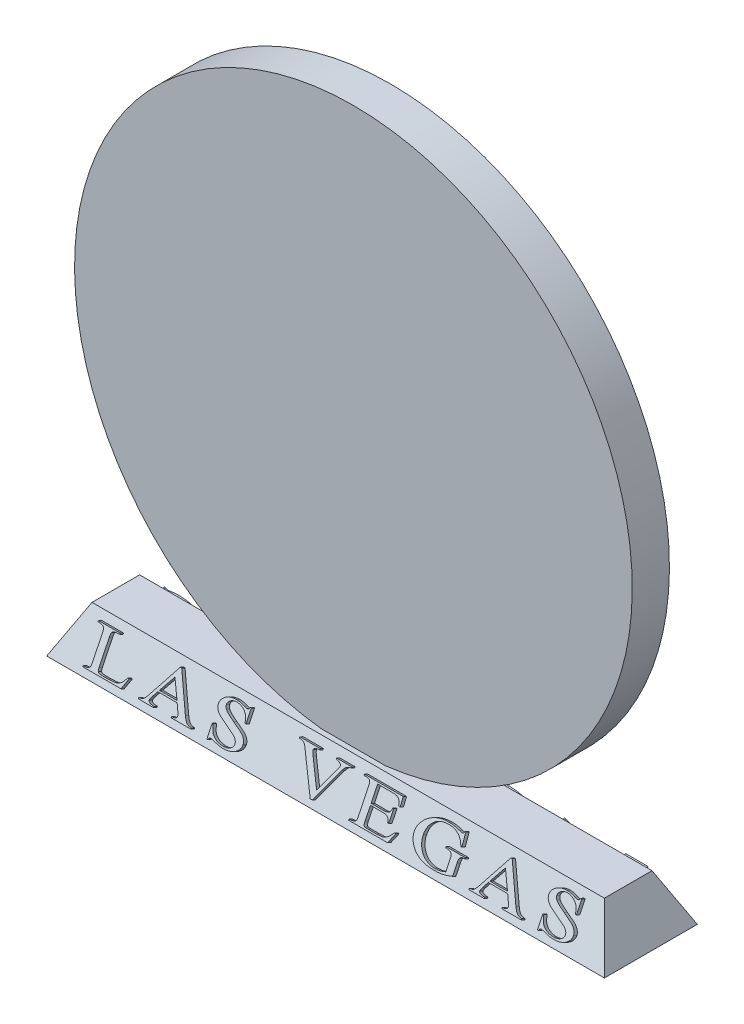
from build123d import *

# Parameters (mm, degrees)
SKETCH1_W                = 76.2
SKETCH1_H                = 12.7
BOSS_EXTRUDE1_DEPTH      = 6.35
BOSS_EXTRUDE1_TAPER      = 26
BOSS_EXTRUDE2_DEPTH      = 2.54
BOSS_EXTRUDE2_DEPTH_BACK = 2.54
SKETCH2_R                = 38.1
BOSS_EXTRUDE3_DEPTH      = 0.508
BOSS_EXTRUDE4_DEPTH      = 0.508


with BuildPart() as part:
    # Sketch1 → Boss-Extrude1 (new body)
    with BuildSketch(Plane(origin=(0, 0, 0), x_dir=(1, 0, 0), z_dir=(0, 1, 0))):
        Rectangle(SKETCH1_W, SKETCH1_H)
    extrude(amount=BOSS_EXTRUDE1_DEPTH, taper=BOSS_EXTRUDE1_TAPER)

    # Sketch2 → Boss-Extrude2 (add, two sides: drawn at the far end of the back side and taken through both)
    with BuildSketch(Plane.XY.offset(-BOSS_EXTRUDE2_DEPTH_BACK)):
        with Locations((0, 44.196)):
            Circle(SKETCH2_R)
    extrude(amount=BOSS_EXTRUDE2_DEPTH + BOSS_EXTRUDE2_DEPTH_BACK)

    # Sketch5 → Boss-Extrude3 (add)
    # profile 1 of 8: a face of its own
    with BuildSketch(Plane(origin=(0, 2.501934143, 5.129725184), x_dir=(1, 0, 0), z_dir=(0, 0.43837114678907857, 0.8987940462991666))):
        with BuildLine():
            Line((-27.624449526, -0.424665252), (-27.420614709, -0.449082964))
            Line((-27.420614709, -0.449082964), (-27.964174219, -1.715619088))
            Line((-27.964174219, -1.715619088), (-33.195934504, -1.715619088))
            Line((-33.195934504, -1.715619088), (-33.195934504, -1.579729211))
            Line((-33.195934504, -1.579729211), (-32.947510821, -1.579729211))
            add(Edge.make_bspline(
                [(-32.947510821, -1.579729211), (-32.913869199, -1.579148281), (-32.848565736, -1.57802061), (-32.754481823, -1.568529181), (-32.667760355, -1.55280257), (-32.588768612, -1.530594652), (-32.516513194, -1.502000968), (-32.45224979, -1.465909022), (-32.394439984, -1.424520859), (-32.362442842, -1.391271802), (-32.346622769, -1.374832755)],
                knots=[0, 0, 0, 0, 1.234331042, 2.396022728, 3.465812733, 4.464759607, 5.402847747, 6.309765673, 7.16431189, 8, 8, 8, 8], degree=3))
            add(Edge.make_bspline(
                [(-32.346622769, -1.374832755), (-32.337949699, -1.363825272), (-32.31913129, -1.339941765), (-32.300886293, -1.294072191), (-32.281813848, -1.241035354), (-32.269275471, -1.177280235), (-32.256998187, -1.104842351), (-32.250686571, -1.02208252), (-32.2445829, -0.930449603), (-32.244663383, -0.865967492), (-32.244705361, -0.832334885)],
                knots=[0, 0, 0, 0, 0.597013913, 1.295372039, 2.095432819, 3.010694239, 4.069210689, 5.240533712, 6.560716361, 8, 8, 8, 8], degree=3))
            Line((-32.244705361, -0.832334885), (-32.244705361, 2.293132298))
            add(Edge.make_bspline(
                [(-32.244705361, 2.293132298), (-32.24505825, 2.330300883), (-32.245727644, 2.400805871), (-32.252161116, 2.501428936), (-32.262280883, 2.591191072), (-32.276865519, 2.670028055), (-32.295571751, 2.738321814), (-32.319881673, 2.79512986), (-32.346844027, 2.842850603), (-32.370522869, 2.866823485), (-32.381656878, 2.878095755)],
                knots=[0, 0, 0, 0, 1.450609605, 2.751657388, 3.933844703, 4.974125523, 5.879155417, 6.689887004, 7.383972823, 8, 8, 8, 8], degree=3))
            add(Edge.make_bspline(
                [(-32.381656878, 2.878095755), (-32.416075275, 2.903515495), (-32.488247195, 2.956818135), (-32.62258861, 3.00543825), (-32.777724388, 3.034979866), (-32.888600512, 3.038602082), (-32.947510821, 3.040526624)],
                knots=[0, 0, 0, 0, 0.851572576, 1.785662154, 2.823485879, 4, 4, 4, 4], degree=3))
            Line((-32.947510821, 3.040526624), (-33.195934504, 3.040526624))
            Line((-33.195934504, 3.040526624), (-33.195934504, 3.176416502))
            Line((-33.195934504, 3.176416502), (-30.206357198, 3.176416502))
            Line((-30.206357198, 3.176416502), (-30.206357198, 3.040526624))
            add(Edge.make_bspline(
                [(-30.206357198, 3.040526624), (-30.24776348, 3.040789259), (-30.327405689, 3.041294419), (-30.442091307, 3.037823204), (-30.547218797, 3.032600398), (-30.642902313, 3.025692461), (-30.728932299, 3.014958037), (-30.80545103, 3.002327944), (-30.872754466, 2.988158979), (-30.946638991, 2.964563511), (-31.024854526, 2.931050571), (-31.106361495, 2.887723421), (-31.169608168, 2.835867844), (-31.212603807, 2.78787324), (-31.237290437, 2.741440681), (-31.251223228, 2.696656772), (-31.26539688, 2.642985629), (-31.275201693, 2.578557973), (-31.284018634, 2.504594622), (-31.288305812, 2.42019636), (-31.293377936, 2.326100692), (-31.293442433, 2.259877012), (-31.293476218, 2.225187359)],
                knots=[0, 0, 0, 0, 1.511868658, 2.907978038, 4.188882039, 5.355370269, 6.409994922, 7.353209078, 8.187150806, 8.918697782, 10.18108741, 11.291849465, 12.274682813, 13.154894626, 13.623126059, 14.182961435, 14.863054094, 15.649065891, 16.55949071, 17.582367673, 18.733582548, 20, 20, 20, 20], degree=3))
            Line((-31.293476218, 2.225187359), (-31.293476218, -0.936375572))
            add(Edge.make_bspline(
                [(-31.293476218, -0.936375572), (-31.292610802, -0.983870728), (-31.291023333, -1.070993004), (-31.276349356, -1.189290953), (-31.254774547, -1.285544928), (-31.227217046, -1.336999538), (-31.214914883, -1.3599698)],
                knots=[0, 0, 0, 0, 1.307343054, 2.39811201, 3.284888469, 4, 4, 4, 4], degree=3))
            add(Edge.make_bspline(
                [(-31.214914883, -1.3599698), (-31.204026737, -1.37246497), (-31.18180505, -1.397966443), (-31.138932596, -1.428509663), (-31.089615438, -1.455343861), (-31.040443661, -1.47404892), (-30.989084007, -1.484598939), (-30.933718812, -1.49150331), (-30.862180564, -1.497714346), (-30.774377799, -1.502787219), (-30.670319113, -1.506843713), (-30.549996617, -1.510327213), (-30.413374696, -1.510604855), (-30.316766857, -1.511376992), (-30.26580902, -1.511784272)],
                knots=[0, 0, 0, 0, 0.602391911, 1.229425536, 1.904894505, 2.647842038, 3.136240154, 3.813186097, 4.681067088, 5.753859201, 7.019290058, 8.4777091, 10.142093526, 12, 12, 12, 12], degree=3))
            Line((-30.26580902, -1.511784272), (-29.778516412, -1.511784272))
            add(Edge.make_bspline(
                [(-29.778516412, -1.511784272), (-29.716937607, -1.511707493), (-29.59836407, -1.511559651), (-29.427783906, -1.50691117), (-29.271655876, -1.501077079), (-29.13002581, -1.491682216), (-29.002602795, -1.478899157), (-28.88928021, -1.464249498), (-28.790209591, -1.448006211), (-28.677675495, -1.420956638), (-28.549427019, -1.376450208), (-28.403600993, -1.3081869), (-28.264989911, -1.222352836), (-28.130422176, -1.11865765), (-27.999549638, -0.989609285), (-27.873361707, -0.829027964), (-27.744002373, -0.639951745), (-27.665727253, -0.498996708), (-27.624449526, -0.424665252)],
                knots=[0, 0, 0, 0, 1.137770988, 2.190843571, 3.152848351, 4.02449838, 4.813068592, 5.518684204, 6.135727158, 6.667022728, 7.655442757, 8.638266805, 9.636372183, 10.661777016, 11.771487676, 13.02245196, 14.429815025, 16, 16, 16, 16], degree=3))
        make_face()
    # profile 2 of 8: a face of its own
    with BuildSketch(Plane(origin=(0, 2.501934143, 5.129725184), x_dir=(1, 0, 0), z_dir=(0, 0.43837114678907857, 0.8987940462991666))):
        with BuildLine():
            Line((-20.996208422, -0.084940558), (-23.637567916, -0.084940558))
            Line((-23.637567916, -0.084940558), (-24.118490686, -0.855690957))
            add(Edge.make_bspline(
                [(-24.118490686, -0.855690957), (-24.14414402, -0.899130709), (-24.190999391, -0.978472661), (-24.243041329, -1.09308992), (-24.278902219, -1.18943813), (-24.284736186, -1.24970438), (-24.287291393, -1.276100266)],
                knots=[0, 0, 0, 0, 1.322840153, 2.416144599, 3.306290551, 4, 4, 4, 4], degree=3))
            add(Edge.make_bspline(
                [(-24.287291393, -1.276100266), (-24.285383542, -1.294530385), (-24.281496953, -1.332075388), (-24.25003778, -1.38420408), (-24.203264676, -1.432113927), (-24.15029734, -1.467954529), (-24.096204629, -1.493531042), (-24.043143657, -1.511508869), (-23.979507197, -1.526982858), (-23.905299659, -1.540249706), (-23.820697791, -1.55300447), (-23.725560048, -1.565051708), (-23.619214852, -1.572723398), (-23.544853892, -1.577321843), (-23.505924598, -1.579729211)],
                knots=[0, 0, 0, 0, 0.730504639, 1.488150928, 2.36610824, 3.391173878, 4.015817613, 4.747410933, 5.619798187, 6.624078009, 7.751208096, 9.030165015, 10.445238214, 12, 12, 12, 12], degree=3))
            Line((-23.505924598, -1.579729211), (-23.505924598, -1.715619088))
            Line((-23.505924598, -1.715619088), (-25.594169825, -1.715619088))
            Line((-25.594169825, -1.715619088), (-25.594169825, -1.579729211))
            add(Edge.make_bspline(
                [(-25.594169825, -1.579729211), (-25.560501235, -1.575450274), (-25.496179246, -1.567275601), (-25.404751827, -1.550509705), (-25.322051275, -1.53532247), (-25.248777335, -1.51821473), (-25.184585103, -1.500923123), (-25.130735116, -1.480300793), (-25.085067621, -1.460807262), (-25.059305073, -1.444834765), (-25.047425396, -1.437469495)],
                knots=[0, 0, 0, 0, 1.431729132, 2.735239809, 3.921251242, 4.978873696, 5.910040711, 6.722686219, 7.411002558, 8, 8, 8, 8], degree=3))
            add(Edge.make_bspline(
                [(-25.047425396, -1.437469495), (-25.025482276, -1.421630613), (-24.979350123, -1.388331714), (-24.913871933, -1.326455988), (-24.846179597, -1.254494648), (-24.776977462, -1.170957821), (-24.706333852, -1.076343331), (-24.632731886, -0.971255768), (-24.558600651, -0.85400719), (-24.509993524, -0.771258094), (-24.484756371, -0.728294197)],
                knots=[0, 0, 0, 0, 0.711698957, 1.496241436, 2.366122196, 3.311944939, 4.349682111, 5.473800356, 6.688379847, 8, 8, 8, 8], degree=3))
            Line((-24.484756371, -0.728294197), (-22.006889386, 3.244361441))
            Line((-22.006889386, 3.244361441), (-21.839150319, 3.244361441))
            Line((-21.839150319, 3.244361441), (-19.566179789, -0.787746019))
            add(Edge.make_bspline(
                [(-19.566179789, -0.787746019), (-19.543065004, -0.826468386), (-19.498565797, -0.901014378), (-19.430253997, -1.006538892), (-19.364211991, -1.102123534), (-19.298077884, -1.186025638), (-19.234510939, -1.259563178), (-19.172984946, -1.322925127), (-19.112554359, -1.375120522), (-19.0325912, -1.432200401), (-18.920905209, -1.487683273), (-18.769098063, -1.534176316), (-18.595720249, -1.567493029), (-18.472146972, -1.575499686), (-18.406869272, -1.579729211)],
                knots=[0, 0, 0, 0, 1.088624117, 2.095754237, 3.034311338, 3.89226337, 4.673448859, 5.380273665, 6.022442581, 6.59846551, 7.748513958, 9.012978332, 10.422103011, 12, 12, 12, 12], degree=3))
            Line((-18.406869272, -1.579729211), (-18.406869272, -1.715619088))
            Line((-18.406869272, -1.715619088), (-21.10024911, -1.715619088))
            Line((-21.10024911, -1.715619088), (-21.10024911, -1.579729211))
            add(Edge.make_bspline(
                [(-21.10024911, -1.579729211), (-21.068046022, -1.578010507), (-21.006438595, -1.57472247), (-20.917789422, -1.569190234), (-20.837566934, -1.558925537), (-20.76506292, -1.549237916), (-20.701232136, -1.535455571), (-20.645850458, -1.51907425), (-20.597439246, -1.503272119), (-20.546729293, -1.47642331), (-20.494693634, -1.440702959), (-20.448925395, -1.390232983), (-20.418908409, -1.334584547), (-20.41591984, -1.294848899), (-20.414429884, -1.275038626)],
                knots=[0, 0, 0, 0, 1.417713194, 2.712213945, 3.902715673, 4.971887145, 5.926891796, 6.768775501, 7.511717757, 8.158734426, 9.285322538, 10.2658318, 11.135427591, 12, 12, 12, 12], degree=3))
            add(Edge.make_bspline(
                [(-20.414429884, -1.275038626), (-20.41510187, -1.260480213), (-20.416540037, -1.229322654), (-20.42748995, -1.180187176), (-20.441572882, -1.124774049), (-20.465173321, -1.064446745), (-20.492432107, -0.997252499), (-20.52655009, -0.924324002), (-20.56690534, -0.845702949), (-20.597185193, -0.792237507), (-20.612956502, -0.764389946)],
                knots=[0, 0, 0, 0, 0.631962696, 1.352511031, 2.180352332, 3.114168253, 4.161877917, 5.331107439, 6.609903053, 8, 8, 8, 8], degree=3))
            Line((-20.612956502, -0.764389946), (-20.996208422, -0.084940558))
        make_face()
        Polygon((-21.109803867, 0.118894258), (-22.25000487, 2.082927644), (-23.510171156, 0.118894258), align=None, mode=Mode.SUBTRACT)
    # profile 3 of 8: a face of its own
    with BuildSketch(Plane(origin=(0, 2.501934143, 5.129725184), x_dir=(1, 0, 0), z_dir=(0, 0.43837114678907857, 0.8987940462991666))):
        with BuildLine():
            Line((-12.323249318, 3.244361441), (-12.323249318, 1.545737972))
            Line((-12.323249318, 1.545737972), (-12.459139196, 1.545737972))
            add(Edge.make_bspline(
                [(-12.459139196, 1.545737972), (-12.466667768, 1.587896067), (-12.481396185, 1.670371463), (-12.507370121, 1.790776819), (-12.539609567, 1.903871631), (-12.574375848, 2.010733092), (-12.613669824, 2.1107356), (-12.657217002, 2.204360183), (-12.704616134, 2.291580638), (-12.77485129, 2.398323368), (-12.874491088, 2.522685242), (-13.019503588, 2.652878386), (-13.185940292, 2.768018526), (-13.3731275, 2.864174379), (-13.57241455, 2.941066991), (-13.777740595, 3.000258264), (-13.987547257, 3.033069226), (-14.128641026, 3.038041325), (-14.199166612, 3.040526624)],
                knots=[0, 0, 0, 0, 0.811969571, 1.588485222, 2.334093912, 3.040641239, 3.718441249, 4.369823237, 4.997410722, 5.598507837, 6.79100164, 8.006898229, 9.279950736, 10.618389194, 11.986484706, 13.324704519, 14.662756118, 16, 16, 16, 16], degree=3))
            add(Edge.make_bspline(
                [(-14.199166612, 3.040526624), (-14.238483469, 3.040131652), (-14.315886202, 3.039354073), (-14.428935775, 3.026828957), (-14.53692793, 3.00936681), (-14.639480694, 2.983587248), (-14.737266427, 2.950944675), (-14.829477361, 2.910502367), (-14.91689685, 2.863522043), (-14.997313138, 2.808607383), (-15.070760252, 2.75003344), (-15.13580352, 2.68920268), (-15.18953519, 2.625312391), (-15.235582952, 2.56037348), (-15.269183799, 2.491971633), (-15.294141804, 2.422240534), (-15.309584301, 2.35042229), (-15.311742014, 2.301699166), (-15.312826623, 2.277207703)],
                knots=[0, 0, 0, 0, 1.268642175, 2.497564082, 3.667724357, 4.798283559, 5.907453997, 6.992110669, 8.045261115, 9.106806281, 10.1309893, 11.076510323, 11.976191164, 12.822338366, 13.63984745, 14.427595244, 15.209605419, 16, 16, 16, 16], degree=3))
            add(Edge.make_bspline(
                [(-15.312826623, 2.277207703), (-15.310758155, 2.239716), (-15.30663883, 2.165051821), (-15.267102037, 2.056829515), (-15.206545935, 1.953527425), (-15.149956085, 1.893983341), (-15.120669844, 1.863168233)],
                knots=[0, 0, 0, 0, 0.956181432, 1.904221335, 2.915397742, 4, 4, 4, 4], degree=3))
            add(Edge.make_bspline(
                [(-15.120669844, 1.863168233), (-15.0941947, 1.838946844), (-15.035577155, 1.785319248), (-14.929049545, 1.709511459), (-14.800888199, 1.625026534), (-14.647180022, 1.538474875), (-14.471397886, 1.443055374), (-14.271078911, 1.343097319), (-14.047052169, 1.236857089), (-13.888968492, 1.166395688), (-13.806359935, 1.129575222)],
                knots=[0, 0, 0, 0, 0.569551795, 1.261021587, 2.073365244, 3.007705136, 4.061586441, 5.250720607, 6.563330443, 8, 8, 8, 8], degree=3))
            add(Edge.make_bspline(
                [(-13.806359935, 1.129575222), (-13.738378634, 1.099577139), (-13.607215005, 1.041698613), (-13.418252551, 0.956737586), (-13.244075012, 0.87725052), (-13.08534339, 0.802939344), (-12.941674572, 0.735351111), (-12.813778645, 0.672258646), (-12.700884318, 0.615284685), (-12.571973201, 0.548920666), (-12.430114514, 0.465495154), (-12.279109785, 0.356345074), (-12.149478278, 0.237073223), (-12.042265924, 0.109187868), (-11.954603033, -0.022773624), (-11.893896898, -0.160755496), (-11.853809761, -0.301381019), (-11.849687262, -0.397153214), (-11.847634747, -0.444836406)],
                knots=[0, 0, 0, 0, 1.344226971, 2.593561546, 3.748049555, 4.807749135, 5.764203613, 6.620261992, 7.387553331, 8.051869777, 9.243118291, 10.360975143, 11.416508954, 12.420624894, 13.374182611, 14.271199901, 15.139262628, 16, 16, 16, 16], degree=3))
            add(Edge.make_bspline(
                [(-11.847634747, -0.444836406), (-11.849495777, -0.489925408), (-11.853180142, -0.579190158), (-11.881951265, -0.710029256), (-11.927967664, -0.835948924), (-11.993707654, -0.956961473), (-12.078761035, -1.072530712), (-12.180117085, -1.18503858), (-12.301295569, -1.291210656), (-12.439569385, -1.390791685), (-12.591704835, -1.482733235), (-12.7558732, -1.564049879), (-12.931460975, -1.631169953), (-13.116821705, -1.687972386), (-13.31281532, -1.731199881), (-13.519620398, -1.761814638), (-13.737033645, -1.77977533), (-13.885595495, -1.782284431), (-13.961359326, -1.783564027)],
                knots=[0, 0, 0, 0, 0.784296799, 1.552708079, 2.320575946, 3.111617437, 3.940879883, 4.813140217, 5.742664873, 6.739500421, 7.77588398, 8.833775286, 9.92397671, 11.044457731, 12.205717329, 13.414058399, 14.681217001, 16, 16, 16, 16], degree=3))
            add(Edge.make_bspline(
                [(-13.961359326, -1.783564027), (-14.055927238, -1.782128242), (-14.239696872, -1.779338143), (-14.422537763, -1.760741596), (-14.511288674, -1.751714837)],
                knots=[0, 0, 0, 0, 1.029200629, 2, 2, 2, 2], degree=3))
            add(Edge.make_bspline(
                [(-14.511288674, -1.751714837), (-14.525802807, -1.749625479), (-14.55805332, -1.74498291), (-14.611889725, -1.736374245), (-14.675980414, -1.724827269), (-14.750155745, -1.709591362), (-14.834820202, -1.692679123), (-14.92969446, -1.672642205), (-15.035108383, -1.649077267), (-15.146910528, -1.623491283), (-15.25809598, -1.597091263), (-15.362279493, -1.575040319), (-15.455380818, -1.556090913), (-15.537311254, -1.539538186), (-15.608225397, -1.528154395), (-15.668007617, -1.519451696), (-15.716853139, -1.513661743), (-15.74596536, -1.512356092), (-15.758715284, -1.511784272)],
                knots=[0, 0, 0, 0, 0.553680816, 1.230282913, 2.058516825, 3.012386492, 4.089423837, 5.318518057, 6.673634068, 8.167919426, 9.649183879, 10.988395777, 12.188605868, 13.236827395, 14.14407283, 14.899946675, 15.518223064, 16, 16, 16, 16], degree=3))
            add(Edge.make_bspline(
                [(-15.758715284, -1.511784272), (-15.778208406, -1.512362455), (-15.81533243, -1.513463587), (-15.868228274, -1.522607556), (-15.914310358, -1.53999579), (-15.955963509, -1.563260967), (-15.989955529, -1.599821398), (-16.019149687, -1.648461344), (-16.042457866, -1.711274102), (-16.054013507, -1.758301773), (-16.06022095, -1.783564027)],
                knots=[0, 0, 0, 0, 1.032392494, 1.966158241, 2.826088242, 3.63290472, 4.467963999, 5.435541267, 6.622427894, 8, 8, 8, 8], degree=3))
            Line((-16.06022095, -1.783564027), (-16.196110827, -1.783564027))
            Line((-16.196110827, -1.783564027), (-16.196110827, -0.084940558))
            Line((-16.196110827, -0.084940558), (-16.06022095, -0.084940558))
            add(Edge.make_bspline(
                [(-16.06022095, -0.084940558), (-16.049665608, -0.13069689), (-16.029187328, -0.219468147), (-15.992522585, -0.347071373), (-15.954715261, -0.465837135), (-15.914424538, -0.575832977), (-15.871075867, -0.676979472), (-15.824162598, -0.76925149), (-15.775921596, -0.853602275), (-15.705452961, -0.954285026), (-15.600400048, -1.068739594), (-15.450379867, -1.192855841), (-15.270856901, -1.302441283), (-15.067721995, -1.400228018), (-14.844768097, -1.480270716), (-14.607978852, -1.536846235), (-14.360966057, -1.573472204), (-14.192575592, -1.57761767), (-14.106803961, -1.579729211)],
                knots=[0, 0, 0, 0, 0.830944428, 1.612104324, 2.348920271, 3.036524518, 3.684568663, 4.295183049, 4.86773668, 5.402894833, 6.467109907, 7.605827739, 8.838008739, 10.179808939, 11.59033331, 13.021289123, 14.482759153, 16, 16, 16, 16], degree=3))
            add(Edge.make_bspline(
                [(-14.106803961, -1.579729211), (-14.057583491, -1.579367823), (-13.961822973, -1.578664728), (-13.822270782, -1.566005354), (-13.690605015, -1.548782951), (-13.566782877, -1.523196624), (-13.450677899, -1.490398578), (-13.342228241, -1.450278269), (-13.241833071, -1.40258269), (-13.150609413, -1.347064712), (-13.068577387, -1.287364393), (-12.99648949, -1.224373967), (-12.935677594, -1.158730402), (-12.885965948, -1.089987757), (-12.847480968, -1.018531045), (-12.819520931, -0.944345088), (-12.80162787, -0.867510607), (-12.799786927, -0.815090685), (-12.79886389, -0.788807658)],
                knots=[0, 0, 0, 0, 1.401152189, 2.726001192, 3.987348202, 5.181141595, 6.323193165, 7.420155979, 8.47043403, 9.483248901, 10.456847669, 11.356549374, 12.205308316, 12.99960931, 13.766125027, 14.509228086, 15.25253613, 16, 16, 16, 16], degree=3))
            add(Edge.make_bspline(
                [(-12.79886389, -0.788807658), (-12.800177228, -0.75891038), (-12.802862579, -0.697780188), (-12.829440467, -0.607074208), (-12.868922668, -0.515860023), (-12.924996306, -0.425083151), (-12.997601309, -0.335755284), (-13.087912228, -0.249808542), (-13.194767151, -0.166268745), (-13.274995747, -0.117046648), (-13.316944048, -0.091310396)],
                knots=[0, 0, 0, 0, 0.788449806, 1.612122954, 2.479263882, 3.411325802, 4.422237986, 5.513760577, 6.700045585, 8, 8, 8, 8], degree=3))
            add(Edge.make_bspline(
                [(-13.316944048, -0.091310396), (-13.334921879, -0.080921127), (-13.376748186, -0.056749982), (-13.449837223, -0.01913197), (-13.542160995, 0.025538467), (-13.652903918, 0.078325445), (-13.782525577, 0.138622749), (-13.930293666, 0.2073495), (-14.098184975, 0.280461754), (-14.278594409, 0.361737691), (-14.46333991, 0.442572817), (-14.639937057, 0.524089035), (-14.806073477, 0.59828754), (-14.958666706, 0.671889861), (-15.101049441, 0.737020035), (-15.229461882, 0.802292148), (-15.347567091, 0.859471173), (-15.48501414, 0.931995171), (-15.639635311, 1.019697534), (-15.803606222, 1.133570276), (-15.943099199, 1.253442994), (-16.060156972, 1.377785957), (-16.150668387, 1.509996528), (-16.216927566, 1.648163888), (-16.256832958, 1.794077339), (-16.261637957, 1.893716026), (-16.264055766, 1.943852847)],
                knots=[0, 0, 0, 0, 0.399613404, 0.929720234, 1.58162229, 2.373764673, 3.290976074, 4.333294083, 5.510381188, 6.815412375, 8.141882302, 9.39163454, 10.559084663, 11.643783659, 12.65234987, 13.572288668, 14.416074464, 15.177761321, 16.56333574, 17.835039181, 19.013426261, 20.097975544, 21.112504228, 22.084456255, 23.036124645, 24, 24, 24, 24], degree=3))
            add(Edge.make_bspline(
                [(-16.264055766, 1.943852847), (-16.262427878, 1.987498234), (-16.259196717, 2.074129037), (-16.233103619, 2.201569537), (-16.188856716, 2.323886141), (-16.127398236, 2.441138595), (-16.050671757, 2.554836326), (-15.954716397, 2.662511427), (-15.841482257, 2.764933646), (-15.713805675, 2.863304883), (-15.572666495, 2.953065983), (-15.419623284, 3.030235366), (-15.258175258, 3.097737212), (-15.086818663, 3.151561818), (-14.906406813, 3.192849878), (-14.716962887, 3.222271833), (-14.518020776, 3.240676536), (-14.382163253, 3.243115516), (-14.312762056, 3.244361441)],
                knots=[0, 0, 0, 0, 0.80862421, 1.605021022, 2.399794962, 3.212560001, 4.053202897, 4.936339803, 5.87895061, 6.880124963, 7.921150678, 8.974444607, 10.053871323, 11.161808049, 12.299640523, 13.481736502, 14.713575099, 16, 16, 16, 16], degree=3))
            add(Edge.make_bspline(
                [(-14.312762056, 3.244361441), (-14.222778821, 3.241937501), (-14.039727368, 3.23700652), (-13.761355953, 3.201543342), (-13.47509802, 3.143107881), (-13.284044025, 3.087875319), (-13.186362368, 3.059636138)],
                knots=[0, 0, 0, 0, 0.942500087, 1.917312822, 2.935168383, 4, 4, 4, 4], degree=3))
            add(Edge.make_bspline(
                [(-13.186362368, 3.059636138), (-13.144041408, 3.046339252), (-13.0665729, 3.021999306), (-12.959236583, 2.996514117), (-12.872821024, 2.97660741), (-12.821231428, 2.973799223), (-12.79886389, 2.972581686)],
                knots=[0, 0, 0, 0, 1.336020878, 2.445585909, 3.3260576, 4, 4, 4, 4], degree=3))
            add(Edge.make_bspline(
                [(-12.79886389, 2.972581686), (-12.778285241, 2.97303082), (-12.738943791, 2.973889456), (-12.683191036, 2.984786416), (-12.633487654, 3.00191545), (-12.58797052, 3.025537763), (-12.547012713, 3.060715872), (-12.513863254, 3.110588447), (-12.482217539, 3.171889856), (-12.467237948, 3.2189294), (-12.459139196, 3.244361441)],
                knots=[0, 0, 0, 0, 1.033350438, 1.975518682, 2.842075013, 3.669956951, 4.540340766, 5.522808214, 6.66070039, 8, 8, 8, 8], degree=3))
            Line((-12.459139196, 3.244361441), (-12.323249318, 3.244361441))
        make_face()
    # profile 4 of 8: a face of its own
    with BuildSketch(Plane(origin=(0, 2.501934143, 5.129725184), x_dir=(1, 0, 0), z_dir=(0, 0.43837114678907857, 0.8987940462991666))):
        with BuildLine():
            Line((1.426895334, 3.176416502), (1.426895334, 3.040526624))
            add(Edge.make_bspline(
                [(1.426895334, 3.040526624), (1.370441326, 3.031911888), (1.264151595, 3.015692348), (1.11691504, 2.97868398), (0.990295649, 2.933696854), (0.918221425, 2.891519482), (0.884397464, 2.871725917)],
                knots=[0, 0, 0, 0, 1.196454043, 2.252643935, 3.179977241, 4, 4, 4, 4], degree=3))
            add(Edge.make_bspline(
                [(0.884397464, 2.871725917), (0.840541635, 2.838944095), (0.749895025, 2.771186599), (0.629783921, 2.642298403), (0.516069739, 2.491277275), (0.450430724, 2.378474963), (0.41621437, 2.31967329)],
                knots=[0, 0, 0, 0, 0.898353343, 1.856826974, 2.882805174, 4, 4, 4, 4], degree=3))
            Line((0.41621437, 2.31967329), (-1.815352212, -1.783564027))
            Line((-1.815352212, -1.783564027), (-2.070145732, -1.783564027))
            Line((-2.070145732, -1.783564027), (-4.601094701, 2.378063472))
            add(Edge.make_bspline(
                [(-4.601094701, 2.378063472), (-4.616520925, 2.40433845), (-4.645869177, 2.454326361), (-4.689931983, 2.524208744), (-4.728709918, 2.587036463), (-4.764653559, 2.641334642), (-4.797905049, 2.686871662), (-4.82643016, 2.725471632), (-4.851311747, 2.756227617), (-4.86781589, 2.773088029), (-4.874997735, 2.780424906)],
                knots=[0, 0, 0, 0, 1.49929016, 2.852386045, 4.065185114, 5.132613094, 6.055760695, 6.839425783, 7.494971388, 8, 8, 8, 8], degree=3))
            add(Edge.make_bspline(
                [(-4.874997735, 2.780424906), (-4.89651173, 2.799032349), (-4.939730812, 2.836412509), (-5.013741417, 2.883228955), (-5.094051328, 2.924423402), (-5.183187182, 2.960101401), (-5.283539824, 2.990388203), (-5.398845903, 3.012661848), (-5.529573237, 3.031066258), (-5.622329466, 3.037260974), (-5.671227486, 3.040526624)],
                knots=[0, 0, 0, 0, 0.797784732, 1.602655545, 2.451535801, 3.329917284, 4.295076977, 5.390360744, 6.624284371, 8, 8, 8, 8], degree=3))
            Line((-5.671227486, 3.040526624), (-5.671227486, 3.176416502))
            Line((-5.671227486, 3.176416502), (-2.890793196, 3.176416502))
            Line((-2.890793196, 3.176416502), (-2.890793196, 3.040526624))
            add(Edge.make_bspline(
                [(-2.890793196, 3.040526624), (-2.927966936, 3.037900011), (-2.99921324, 3.032865907), (-3.100855016, 3.022443964), (-3.192487071, 3.009520373), (-3.273934227, 2.995887865), (-3.345394664, 2.981652195), (-3.405903308, 2.964524536), (-3.456756878, 2.947026276), (-3.508295153, 2.921136752), (-3.559411108, 2.885167834), (-3.604349225, 2.834428858), (-3.633856349, 2.776880335), (-3.636736764, 2.735463418), (-3.638187522, 2.714603246)],
                knots=[0, 0, 0, 0, 1.512101575, 2.898057803, 4.14492571, 5.266242911, 6.249098183, 7.099215349, 7.816895592, 8.426956754, 9.435183546, 10.330774245, 11.15927264, 12, 12, 12, 12], degree=3))
            add(Edge.make_bspline(
                [(-3.638187522, 2.714603246), (-3.637658712, 2.698606599), (-3.636518161, 2.66410459), (-3.622721631, 2.610221183), (-3.606833614, 2.548972885), (-3.579961602, 2.482635995), (-3.548753189, 2.408709767), (-3.507565814, 2.330281731), (-3.462099245, 2.24393366), (-3.427223205, 2.185738322), (-3.408873354, 2.155119141)],
                knots=[0, 0, 0, 0, 0.627608002, 1.353642169, 2.177508982, 3.115675527, 4.162706612, 5.332723119, 6.596625844, 8, 8, 8, 8], degree=3))
            Line((-3.408873354, 2.155119141), (-1.676277416, -0.693260088))
            Line((-1.676277416, -0.693260088), (-0.147516294, 2.119023393))
            add(Edge.make_bspline(
                [(-0.147516294, 2.119023393), (-0.128792852, 2.152117772), (-0.09307685, 2.215247134), (-0.047095419, 2.308038129), (-0.005924599, 2.391747722), (0.026739314, 2.468005821), (0.053093301, 2.536160604), (0.070520718, 2.596663342), (0.084222614, 2.648886763), (0.085473807, 2.681624704), (0.086044433, 2.696555372)],
                knots=[0, 0, 0, 0, 1.45381305, 2.773228967, 3.959619286, 5.020500116, 5.945532795, 6.750511836, 7.430150691, 8, 8, 8, 8], degree=3))
            add(Edge.make_bspline(
                [(0.086044433, 2.696555372), (0.084381839, 2.713883245), (0.080854139, 2.750649609), (0.049896529, 2.802198519), (0.00356886, 2.851955537), (-0.061555175, 2.900004587), (-0.148454997, 2.94366713), (-0.259148025, 2.979507988), (-0.39374874, 3.010332624), (-0.492392097, 3.023047726), (-0.545631169, 3.029910228)],
                knots=[0, 0, 0, 0, 0.540600892, 1.147049552, 1.839042664, 2.672238656, 3.670900512, 4.879414527, 6.315780407, 8, 8, 8, 8], degree=3))
            add(Edge.make_bspline(
                [(-0.545631169, 3.029910228), (-0.556955326, 3.031325747), (-0.585265717, 3.034864546), (-0.613576108, 3.038403345), (-0.630562343, 3.040526624)],
                knots=[0, 0, 0, 0, 0.8, 2, 2, 2, 2], degree=3))
            Line((-0.630562343, 3.040526624), (-0.630562343, 3.176416502))
            Line((-0.630562343, 3.176416502), (1.426895334, 3.176416502))
        make_face()
    # profile 5 of 8: a face of its own
    with BuildSketch(Plane(origin=(0, 2.501934143, 5.129725184), x_dir=(1, 0, 0), z_dir=(0, 0.43837114678907857, 0.8987940462991666))):
        with BuildLine():
            Line((5.057066015, 2.972581686), (5.057066015, 0.934233523))
            Line((5.057066015, 0.934233523), (6.619799606, 0.934233523))
            add(Edge.make_bspline(
                [(6.619799606, 0.934233523), (6.667223924, 0.934706154), (6.757857038, 0.935609404), (6.887477123, 0.940588401), (7.004763813, 0.949855777), (7.109923271, 0.963749351), (7.202928543, 0.980108618), (7.283588447, 1.000184364), (7.352489324, 1.023637488), (7.392195718, 1.045200154), (7.410721159, 1.055260445)],
                knots=[0, 0, 0, 0, 1.409505364, 2.693720618, 3.854514308, 4.904688028, 5.845404092, 6.659137082, 7.374406135, 8, 8, 8, 8], degree=3))
            add(Edge.make_bspline(
                [(7.410721159, 1.055260445), (7.432042177, 1.069178882), (7.474363767, 1.096806565), (7.529944005, 1.148661245), (7.577946434, 1.207902876), (7.61998308, 1.273735602), (7.652531249, 1.348527172), (7.679260086, 1.429780854), (7.697027782, 1.519322011), (7.703536325, 1.581414991), (7.706918626, 1.613682911)],
                knots=[0, 0, 0, 0, 0.927193459, 1.84045153, 2.757531162, 3.702780152, 4.678972245, 5.723727532, 6.817087292, 8, 8, 8, 8], degree=3))
            Line((7.706918626, 1.613682911), (7.842808504, 1.613682911))
            Line((7.842808504, 1.613682911), (7.842808504, 0.050949319))
            Line((7.842808504, 0.050949319), (7.706918626, 0.050949319))
            add(Edge.make_bspline(
                [(7.706918626, 0.050949319), (7.69533107, 0.101679109), (7.674311699, 0.193700948), (7.640094153, 0.315978182), (7.606368245, 0.409544318), (7.576268227, 0.457528824), (7.563597271, 0.477728466)],
                knots=[0, 0, 0, 0, 1.379067858, 2.501574728, 3.369220285, 4, 4, 4, 4], degree=3))
            add(Edge.make_bspline(
                [(7.563597271, 0.477728466), (7.546638926, 0.497289464), (7.511336632, 0.538009716), (7.440666653, 0.585657604), (7.35839516, 0.630231285), (7.257760227, 0.666024061), (7.136387012, 0.696248724), (6.988731791, 0.716048439), (6.81358879, 0.728433447), (6.687417009, 0.729712983), (6.619799606, 0.730398707)],
                knots=[0, 0, 0, 0, 0.614641696, 1.279503493, 2.01538516, 2.84276168, 3.816625311, 4.992899214, 6.388448312, 8, 8, 8, 8], degree=3))
            Line((6.619799606, 0.730398707), (5.057066015, 0.730398707))
            Line((5.057066015, 0.730398707), (5.057066015, -0.94274541))
            add(Edge.make_bspline(
                [(5.057066015, -0.94274541), (5.057456692, -0.969286266), (5.058201589, -1.019891296), (5.058689492, -1.09175574), (5.061523421, -1.155550038), (5.067530695, -1.210640858), (5.071949434, -1.257956552), (5.079490572, -1.2969082), (5.087413612, -1.328037959), (5.100294313, -1.358521118), (5.122259581, -1.389270864), (5.156014442, -1.419679643), (5.195828717, -1.448006067), (5.246228874, -1.472766092), (5.313503038, -1.490142843), (5.400549197, -1.503511742), (5.510662057, -1.50967744), (5.591423085, -1.511038666), (5.635659634, -1.511784272)],
                knots=[0, 0, 0, 0, 1.274209158, 2.429514355, 3.450064383, 4.337511793, 5.089792034, 5.729495898, 6.240547963, 6.628676978, 7.312006394, 8.033144179, 8.801367549, 9.652292364, 10.711692025, 12.122100788, 13.875895338, 16, 16, 16, 16], degree=3))
            Line((5.635659634, -1.511784272), (6.824696062, -1.511784272))
            add(Edge.make_bspline(
                [(6.824696062, -1.511784272), (6.872472774, -1.511625444), (6.964852499, -1.511318338), (7.098260648, -1.507714209), (7.221454837, -1.503954423), (7.334377428, -1.497571356), (7.437056007, -1.489269494), (7.529860359, -1.478845643), (7.612293125, -1.465991414), (7.709510119, -1.448169436), (7.823003192, -1.415160692), (7.954396346, -1.361407543), (8.083595521, -1.293750941), (8.164681242, -1.237701484), (8.20588927, -1.209216967)],
                knots=[0, 0, 0, 0, 1.1925434, 2.305868807, 3.331153674, 4.268994211, 5.128744398, 5.902311299, 6.599423706, 7.210974064, 8.368521908, 9.541371576, 10.750517006, 12, 12, 12, 12], degree=3))
            add(Edge.make_bspline(
                [(8.20588927, -1.209216967), (8.260691168, -1.165757732), (8.375946301, -1.074357614), (8.536739863, -0.906355111), (8.703229666, -0.712712571), (8.807509213, -0.56813459), (8.861982585, -0.492610191)],
                knots=[0, 0, 0, 0, 0.859623961, 1.807894962, 2.85489191, 4, 4, 4, 4], degree=3))
            Line((8.861982585, -0.492610191), (9.065817401, -0.492610191))
            Line((9.065817401, -0.492610191), (8.46174443, -1.715619088))
            Line((8.46174443, -1.715619088), (3.15460773, -1.715619088))
            Line((3.15460773, -1.715619088), (3.15460773, -1.579729211))
            Line((3.15460773, -1.579729211), (3.390291736, -1.579729211))
            add(Edge.make_bspline(
                [(3.390291736, -1.579729211), (3.42892131, -1.578719122), (3.505802239, -1.576708834), (3.619204746, -1.560290883), (3.72994307, -1.534041607), (3.800668076, -1.507916122), (3.836180397, -1.494798037)],
                knots=[0, 0, 0, 0, 1.014915998, 2.019895037, 3.005753046, 4, 4, 4, 4], degree=3))
            add(Edge.make_bspline(
                [(3.836180397, -1.494798037), (3.860746467, -1.484776409), (3.907745013, -1.465603544), (3.967693617, -1.422843585), (4.017088552, -1.375221874), (4.047234674, -1.326836528), (4.063403859, -1.281519334), (4.075252375, -1.240114428), (4.084148164, -1.190971655), (4.093013934, -1.134408393), (4.098969645, -1.069880751), (4.103212814, -0.997650191), (4.1049941, -0.917627875), (4.105546648, -0.861707063), (4.105836872, -0.832334885)],
                knots=[0, 0, 0, 0, 1.228002892, 2.349352201, 3.395071957, 4.398360268, 4.959937152, 5.625784044, 6.39598283, 7.276738837, 8.283921864, 9.403222605, 10.636053261, 12, 12, 12, 12], degree=3))
            Line((4.105836872, -0.832334885), (4.105836872, 2.293132298))
            add(Edge.make_bspline(
                [(4.105836872, 2.293132298), (4.105327635, 2.331704947), (4.104364698, 2.404643502), (4.099958512, 2.508570857), (4.088805048, 2.600580595), (4.076142071, 2.681394569), (4.057580165, 2.750129676), (4.037417926, 2.808221502), (4.01128211, 2.855000834), (3.988801114, 2.87880361), (3.978440112, 2.889773792)],
                knots=[0, 0, 0, 0, 1.486053843, 2.810038303, 4.00376339, 5.054783151, 5.957433908, 6.742384304, 7.420392275, 8, 8, 8, 8], degree=3))
            add(Edge.make_bspline(
                [(3.978440112, 2.889773792), (3.962805749, 2.901883589), (3.930490119, 2.926914075), (3.874435304, 2.957241897), (3.811947873, 2.983756609), (3.741883044, 3.005190024), (3.664267221, 3.020476762), (3.579528784, 3.031905221), (3.487400277, 3.039764707), (3.423574169, 3.040265489), (3.390291736, 3.040526624)],
                knots=[0, 0, 0, 0, 0.76572303, 1.582720148, 2.461989383, 3.395175509, 4.417798007, 5.525873896, 6.709854959, 8, 8, 8, 8], degree=3))
            Line((3.390291736, 3.040526624), (3.15460773, 3.040526624))
            Line((3.15460773, 3.040526624), (3.15460773, 3.176416502))
            Line((3.15460773, 3.176416502), (8.454312953, 3.176416502))
            Line((8.454312953, 3.176416502), (8.522257891, 2.089297482))
            Line((8.522257891, 2.089297482), (8.318423075, 2.089297482))
            add(Edge.make_bspline(
                [(8.318423075, 2.089297482), (8.309356645, 2.123305627), (8.291925515, 2.188689726), (8.264648396, 2.282374082), (8.235720762, 2.367630144), (8.206811381, 2.444864825), (8.17528452, 2.513130413), (8.145231212, 2.573984431), (8.113323304, 2.626005426), (8.070246471, 2.685449429), (8.007077597, 2.750107584), (7.915978446, 2.814420835), (7.811131366, 2.872283034), (7.73291302, 2.899114467), (7.692055671, 2.913129864)],
                knots=[0, 0, 0, 0, 1.156064388, 2.222650723, 3.204069305, 4.112866896, 4.929583778, 5.672947947, 6.340773037, 6.931292167, 8.082085451, 9.288756549, 10.583782129, 12, 12, 12, 12], degree=3))
            add(Edge.make_bspline(
                [(7.692055671, 2.913129864), (7.673338809, 2.917887604), (7.632962455, 2.928151085), (7.56682433, 2.941191071), (7.490768762, 2.949563413), (7.405205243, 2.958742631), (7.309894385, 2.964269676), (7.204482046, 2.970395717), (7.089397853, 2.971590759), (7.009419505, 2.972243687), (6.968017417, 2.972581686)],
                knots=[0, 0, 0, 0, 0.636369704, 1.372788261, 2.21893627, 3.156493577, 4.208340689, 5.364281318, 6.635577498, 8, 8, 8, 8], degree=3))
            Line((6.968017417, 2.972581686), (5.057066015, 2.972581686))
        make_face()
    # profile 6 of 8: a face of its own
    with BuildSketch(Plane(origin=(0, 2.501934143, 5.129725184), x_dir=(1, 0, 0), z_dir=(0, 0.43837114678907857, 0.8987940462991666))):
        with BuildLine():
            Line((16.98819726, 3.244361441), (17.124087138, 1.681627849))
            Line((17.124087138, 1.681627849), (16.98819726, 1.681627849))
            add(Edge.make_bspline(
                [(16.98819726, 1.681627849), (16.965770599, 1.73109804), (16.92196268, 1.827732399), (16.84780695, 1.96519451), (16.77047048, 2.094205646), (16.688214853, 2.214277098), (16.599630981, 2.323800803), (16.506785863, 2.42423166), (16.409621933, 2.515987232), (16.339981584, 2.570044367), (16.305562954, 2.596761243)],
                knots=[0, 0, 0, 0, 1.12857112, 2.204534629, 3.243878824, 4.25373749, 5.226629348, 6.168645783, 7.094882417, 8, 8, 8, 8], degree=3))
            add(Edge.make_bspline(
                [(16.305562954, 2.596761243), (16.25418839, 2.632467988), (16.150898132, 2.704257578), (15.982884073, 2.7939808), (15.804967029, 2.870616509), (15.616173588, 2.933824561), (15.416200768, 2.980381532), (15.206078411, 3.016226008), (14.98490209, 3.035839711), (14.833811787, 3.038941927), (14.756630678, 3.040526624)],
                knots=[0, 0, 0, 0, 0.915592969, 1.840829937, 2.783308516, 3.750219969, 4.75204166, 5.787208272, 6.869644733, 8, 8, 8, 8], degree=3))
            add(Edge.make_bspline(
                [(14.756630678, 3.040526624), (14.652125415, 3.038462714), (14.44921772, 3.03445542), (14.154824184, 2.998411414), (13.879433877, 2.942122085), (13.623095883, 2.861375113), (13.385622197, 2.757220375), (13.167717266, 2.62884613), (12.967901654, 2.478470894), (12.852394367, 2.359811464), (12.794720571, 2.300563776)],
                knots=[0, 0, 0, 0, 1.160383523, 2.253003731, 3.289118178, 4.27867386, 5.232548333, 6.162871575, 7.082705756, 8, 8, 8, 8], degree=3))
            add(Edge.make_bspline(
                [(12.794720571, 2.300563776), (12.749899026, 2.247871045), (12.661363838, 2.143788046), (12.545985929, 1.975943657), (12.449314599, 1.800466223), (12.370024279, 1.617388332), (12.308502059, 1.426761981), (12.263937911, 1.228909756), (12.236472038, 1.023477867), (12.233541267, 0.884068705), (12.232051547, 0.813206601)],
                knots=[0, 0, 0, 0, 1.019424773, 2.013651306, 2.996768199, 3.968900512, 4.950618127, 5.945487867, 6.955685188, 8, 8, 8, 8], degree=3))
            add(Edge.make_bspline(
                [(12.232051547, 0.813206601), (12.233450988, 0.755490277), (12.236221493, 0.641227943), (12.25303995, 0.47147744), (12.283379625, 0.30602656), (12.323257842, 0.143559536), (12.376644385, -0.014606521), (12.441769582, -0.16867495), (12.51728617, -0.319491581), (12.604953517, -0.464762478), (12.702597702, -0.60347236), (12.807284761, -0.733862418), (12.919229912, -0.855080616), (13.039883658, -0.964927083), (13.165815383, -1.067742999), (13.300453592, -1.159038515), (13.441977173, -1.241050841), (13.590187988, -1.31288999), (13.742719653, -1.374143615), (13.895766877, -1.430803958), (14.05118108, -1.475410353), (14.206717055, -1.514513651), (14.363629812, -1.542549539), (14.521169808, -1.564242615), (14.679973469, -1.577226384), (14.786333782, -1.578895724), (14.839438572, -1.579729211)],
                knots=[0, 0, 0, 0, 1.051299195, 2.081281203, 3.102819182, 4.11265962, 5.125642179, 6.139547038, 7.157051087, 8.194988293, 9.226743424, 10.24441077, 11.238621461, 12.228456083, 13.213916282, 14.197160846, 15.187687712, 16.190841758, 17.193850853, 18.180638045, 19.161619624, 20.137080484, 21.100392203, 22.062970528, 23.03285783, 24, 24, 24, 24], degree=3))
            add(Edge.make_bspline(
                [(14.839438572, -1.579729211), (14.901747111, -1.578964388), (15.025080345, -1.577450501), (15.208507063, -1.563790658), (15.388578337, -1.544355355), (15.565676445, -1.515259678), (15.739424066, -1.478586821), (15.909874193, -1.432098891), (16.077415261, -1.379931083), (16.18650707, -1.33824948), (16.240802934, -1.317504213)],
                knots=[0, 0, 0, 0, 1.042454752, 2.063430105, 3.076354415, 4.072242424, 5.065239094, 6.046299335, 7.027627598, 8, 8, 8, 8], degree=3))
            Line((16.240802934, -1.317504213), (16.240802934, 0.050949319))
            add(Edge.make_bspline(
                [(16.240802934, 0.050949319), (16.240724899, 0.08174376), (16.240575918, 0.14053494), (16.236052948, 0.224437464), (16.229877645, 0.299878355), (16.221644746, 0.367276177), (16.21062899, 0.426382433), (16.195331653, 0.476974574), (16.179013256, 0.519650678), (16.153134857, 0.565679641), (16.112011975, 0.61372763), (16.05272594, 0.663144344), (15.981543978, 0.704587556), (15.913483756, 0.73232249), (15.851369906, 0.751867084), (15.79561277, 0.764385855), (15.731803508, 0.77491819), (15.65945789, 0.782810262), (15.578844357, 0.790960523), (15.489526332, 0.794157443), (15.392229575, 0.797918194), (15.324613011, 0.798198427), (15.289573791, 0.798343646)],
                knots=[0, 0, 0, 0, 1.271395036, 2.427282755, 3.468487536, 4.396484772, 5.230437534, 5.947059493, 6.576596925, 7.11310655, 8.119692074, 9.167438948, 10.287677249, 11.506158039, 12.194821199, 12.974655914, 13.86351606, 14.86403744, 15.979308766, 17.208172416, 18.553261893, 20, 20, 20, 20], degree=3))
            Line((15.289573791, 0.798343646), (15.289573791, 0.934233523))
            Line((15.289573791, 0.934233523), (17.939426403, 0.934233523))
            Line((17.939426403, 0.934233523), (17.939426403, 0.798343646))
            Line((17.939426403, 0.798343646), (17.816276201, 0.798343646))
            add(Edge.make_bspline(
                [(17.816276201, 0.798343646), (17.785453096, 0.797836873), (17.726476884, 0.796867225), (17.641746685, 0.78665118), (17.56436039, 0.772775486), (17.494294595, 0.75110767), (17.431441564, 0.72413402), (17.37647547, 0.689597734), (17.329007479, 0.649245933), (17.303407428, 0.617579245), (17.290764565, 0.601940307)],
                knots=[0, 0, 0, 0, 1.269788931, 2.429584599, 3.513811997, 4.505808417, 5.446276906, 6.324506853, 7.172539528, 8, 8, 8, 8], degree=3))
            add(Edge.make_bspline(
                [(17.290764565, 0.601940307), (17.282586535, 0.589054147), (17.265128542, 0.561545508), (17.245881207, 0.513236121), (17.228569421, 0.457213128), (17.215324082, 0.392463468), (17.204743747, 0.319082973), (17.197969805, 0.237176351), (17.191930737, 0.146937051), (17.191997317, 0.083872506), (17.192032076, 0.050949319)],
                knots=[0, 0, 0, 0, 0.645060736, 1.377038888, 2.192322577, 3.126948234, 4.1717303, 5.330349853, 6.606294698, 8, 8, 8, 8], degree=3))
            Line((17.192032076, 0.050949319), (17.192032076, -1.371647836))
            add(Edge.make_bspline(
                [(17.192032076, -1.371647836), (17.097156695, -1.405866275), (16.909159043, -1.473670863), (16.624258536, -1.557723854), (16.341695622, -1.629206354), (16.058450255, -1.687580032), (15.768224065, -1.731403602), (15.465288122, -1.761781716), (15.146827095, -1.779812445), (14.929347695, -1.782295217), (14.818205779, -1.783564027)],
                knots=[0, 0, 0, 0, 0.998725421, 1.978996348, 2.940420296, 3.884873212, 4.842045714, 5.846101274, 6.899259281, 8, 8, 8, 8], degree=3))
            add(Edge.make_bspline(
                [(14.818205779, -1.783564027), (14.737863908, -1.783035036), (14.579230544, -1.781990555), (14.345169517, -1.771248788), (14.118257329, -1.75301779), (13.898735752, -1.728698174), (13.686473869, -1.698445287), (13.481813718, -1.65990621), (13.284369642, -1.614759176), (13.094610285, -1.560865554), (12.911334175, -1.503856409), (12.736992891, -1.43570549), (12.568889562, -1.363216262), (12.408657868, -1.282142062), (12.254991522, -1.195003077), (12.108979387, -1.100722424), (11.969835037, -0.999963174), (11.883372908, -0.926336528), (11.84030651, -0.889663427)],
                knots=[0, 0, 0, 0, 1.213670297, 2.396366935, 3.538706935, 4.652159461, 5.732560832, 6.776898939, 7.797499776, 8.791083334, 9.756479752, 10.695705702, 11.617423289, 12.521166942, 13.407072056, 14.284956099, 15.145744339, 16, 16, 16, 16], degree=3))
            add(Edge.make_bspline(
                [(11.84030651, -0.889663427), (11.779381017, -0.83381073), (11.660555713, -0.724879092), (11.505061017, -0.546381293), (11.373297639, -0.361904717), (11.265299106, -0.170882199), (11.180285707, 0.026473363), (11.121137363, 0.230844276), (11.08323598, 0.441284835), (11.079082011, 0.584084585), (11.076987589, 0.65608393)],
                knots=[0, 0, 0, 0, 1.113851123, 2.172386177, 3.185332848, 4.166115697, 5.126059401, 6.075879639, 7.029862418, 8, 8, 8, 8], degree=3))
            add(Edge.make_bspline(
                [(11.076987589, 0.65608393), (11.077976544, 0.708899727), (11.079949371, 0.814259859), (11.103197605, 0.970568099), (11.134911769, 1.125884436), (11.184116017, 1.278712255), (11.243495512, 1.431182533), (11.320851394, 1.579543805), (11.407036415, 1.728764042), (11.475305565, 1.823385408), (11.510136573, 1.87166135)],
                knots=[0, 0, 0, 0, 0.964381476, 1.923806225, 2.88272953, 3.858407348, 4.853965446, 5.869138136, 6.91283155, 8, 8, 8, 8], degree=3))
            add(Edge.make_bspline(
                [(11.510136573, 1.87166135), (11.553854179, 1.928303055), (11.641505625, 2.041866624), (11.789194724, 2.199512761), (11.947239082, 2.348658232), (12.117692777, 2.486862243), (12.300118922, 2.614783438), (12.494814668, 2.732182868), (12.700661818, 2.841423056), (12.844870297, 2.903831975), (12.917870773, 2.935424297)],
                knots=[0, 0, 0, 0, 0.960841518, 1.926435495, 2.898515991, 3.878690399, 4.871935064, 5.889563045, 6.931665438, 8, 8, 8, 8], degree=3))
            add(Edge.make_bspline(
                [(12.917870773, 2.935424297), (12.981657127, 2.960229848), (13.110446694, 3.010314166), (13.311231771, 3.072679495), (13.520027087, 3.125458551), (13.737557086, 3.169191368), (13.963297357, 3.20270488), (14.197740822, 3.22749392), (14.44046067, 3.240799153), (14.605155615, 3.243162697), (14.688685739, 3.244361441)],
                knots=[0, 0, 0, 0, 0.90790026, 1.833120618, 2.787479652, 3.764533165, 4.775916228, 5.814574341, 6.891593921, 8, 8, 8, 8], degree=3))
            add(Edge.make_bspline(
                [(14.688685739, 3.244361441), (14.74920921, 3.244077351), (14.86782746, 3.24352057), (15.041271559, 3.23556012), (15.206346425, 3.224586872), (15.339629719, 3.209591648), (15.447564298, 3.195560224), (15.535541118, 3.18115101), (15.632077514, 3.166074733), (15.73585298, 3.145081829), (15.847658305, 3.122722801), (15.967580868, 3.099024365), (16.094988274, 3.069464253), (16.182756283, 3.049678596), (16.228063258, 3.039464985)],
                knots=[0, 0, 0, 0, 1.399070949, 2.741999848, 4.013266118, 5.222996719, 5.842012429, 6.529325737, 7.283855916, 8.100537152, 8.976568999, 9.919993368, 10.926273823, 12, 12, 12, 12], degree=3))
            add(Edge.make_bspline(
                [(16.228063258, 3.039464985), (16.271147873, 3.02911461), (16.349268629, 3.010347375), (16.455732604, 2.990926305), (16.538393688, 2.976275477), (16.586153784, 2.973666288), (16.60600698, 2.972581686)],
                knots=[0, 0, 0, 0, 1.383033594, 2.507707929, 3.379675331, 4, 4, 4, 4], degree=3))
            add(Edge.make_bspline(
                [(16.60600698, 2.972581686), (16.621282514, 2.973109624), (16.651513705, 2.974154446), (16.694697758, 2.984848799), (16.73444509, 3.00263526), (16.771271714, 3.026804198), (16.803765679, 3.06258691), (16.8275247, 3.111830557), (16.844134507, 3.173761318), (16.849426828, 3.219478213), (16.852307383, 3.244361441)],
                knots=[0, 0, 0, 0, 0.885587142, 1.752629684, 2.562013108, 3.405364178, 4.292617973, 5.330908505, 6.547241418, 8, 8, 8, 8], degree=3))
            Line((16.852307383, 3.244361441), (16.98819726, 3.244361441))
        make_face()
    # profile 7 of 8: a face of its own
    with BuildSketch(Plane(origin=(0, 2.501934143, 5.129725184), x_dir=(1, 0, 0), z_dir=(0, 0.43837114678907857, 0.8987940462991666))):
        with BuildLine():
            Line((24.159997874, -0.084940558), (21.518638379, -0.084940558))
            Line((21.518638379, -0.084940558), (21.03771561, -0.855690957))
            add(Edge.make_bspline(
                [(21.03771561, -0.855690957), (21.012062275, -0.899130709), (20.965206905, -0.978472661), (20.913164967, -1.09308992), (20.877304077, -1.18943813), (20.87147011, -1.24970438), (20.868914903, -1.276100266)],
                knots=[0, 0, 0, 0, 1.322840153, 2.416144599, 3.306290551, 4, 4, 4, 4], degree=3))
            add(Edge.make_bspline(
                [(20.868914903, -1.276100266), (20.870822754, -1.294530385), (20.874709342, -1.332075388), (20.906168516, -1.38420408), (20.95294162, -1.432113927), (21.005908956, -1.467954529), (21.060001667, -1.493531042), (21.113062639, -1.511508869), (21.176699099, -1.526982858), (21.250906637, -1.540249706), (21.335508505, -1.55300447), (21.430646247, -1.565051708), (21.536991444, -1.572723398), (21.611352404, -1.577321843), (21.650281698, -1.579729211)],
                knots=[0, 0, 0, 0, 0.730504639, 1.488150928, 2.36610824, 3.391173878, 4.015817613, 4.747410933, 5.619798187, 6.624078009, 7.751208096, 9.030165015, 10.445238214, 12, 12, 12, 12], degree=3))
            Line((21.650281698, -1.579729211), (21.650281698, -1.715619088))
            Line((21.650281698, -1.715619088), (19.562036471, -1.715619088))
            Line((19.562036471, -1.715619088), (19.562036471, -1.579729211))
            add(Edge.make_bspline(
                [(19.562036471, -1.579729211), (19.595705061, -1.575450274), (19.66002705, -1.567275601), (19.751454469, -1.550509705), (19.834155021, -1.53532247), (19.907428961, -1.51821473), (19.971621193, -1.500923123), (20.02547118, -1.480300793), (20.071138674, -1.460807262), (20.096901223, -1.444834765), (20.1087809, -1.437469495)],
                knots=[0, 0, 0, 0, 1.431729132, 2.735239809, 3.921251242, 4.978873696, 5.910040711, 6.722686219, 7.411002558, 8, 8, 8, 8], degree=3))
            add(Edge.make_bspline(
                [(20.1087809, -1.437469495), (20.13072402, -1.421630613), (20.176856172, -1.388331714), (20.242334362, -1.326455988), (20.310026699, -1.254494648), (20.379228834, -1.170957821), (20.449872444, -1.076343331), (20.52347441, -0.971255768), (20.597605645, -0.85400719), (20.646212771, -0.771258094), (20.671449924, -0.728294197)],
                knots=[0, 0, 0, 0, 0.711698957, 1.496241436, 2.366122196, 3.311944939, 4.349682111, 5.473800356, 6.688379847, 8, 8, 8, 8], degree=3))
            Line((20.671449924, -0.728294197), (23.14931691, 3.244361441))
            Line((23.14931691, 3.244361441), (23.317055977, 3.244361441))
            Line((23.317055977, 3.244361441), (25.590026506, -0.787746019))
            add(Edge.make_bspline(
                [(25.590026506, -0.787746019), (25.613141292, -0.826468386), (25.657640499, -0.901014378), (25.725952298, -1.006538892), (25.791994305, -1.102123534), (25.858128412, -1.186025638), (25.921695357, -1.259563178), (25.98322135, -1.322925127), (26.043651937, -1.375120522), (26.123615095, -1.432200401), (26.235301086, -1.487683273), (26.387108233, -1.534176316), (26.560486047, -1.567493029), (26.684059324, -1.575499686), (26.749337024, -1.579729211)],
                knots=[0, 0, 0, 0, 1.088624117, 2.095754237, 3.034311338, 3.89226337, 4.673448859, 5.380273665, 6.022442581, 6.59846551, 7.748513958, 9.012978332, 10.422103011, 12, 12, 12, 12], degree=3))
            Line((26.749337024, -1.579729211), (26.749337024, -1.715619088))
            Line((26.749337024, -1.715619088), (24.055957186, -1.715619088))
            Line((24.055957186, -1.715619088), (24.055957186, -1.579729211))
            add(Edge.make_bspline(
                [(24.055957186, -1.579729211), (24.088160273, -1.578010507), (24.149767701, -1.57472247), (24.238416874, -1.569190234), (24.318639362, -1.558925537), (24.391143375, -1.549237916), (24.454974159, -1.535455571), (24.510355837, -1.51907425), (24.55876705, -1.503272119), (24.609477003, -1.47642331), (24.661512662, -1.440702959), (24.707280901, -1.390232983), (24.737297887, -1.334584547), (24.740286456, -1.294848899), (24.741776412, -1.275038626)],
                knots=[0, 0, 0, 0, 1.417713194, 2.712213945, 3.902715673, 4.971887145, 5.926891796, 6.768775501, 7.511717757, 8.158734426, 9.285322538, 10.2658318, 11.135427591, 12, 12, 12, 12], degree=3))
            add(Edge.make_bspline(
                [(24.741776412, -1.275038626), (24.741104426, -1.260480213), (24.739666259, -1.229322654), (24.728716346, -1.180187176), (24.714633414, -1.124774049), (24.691032975, -1.064446745), (24.663774189, -0.997252499), (24.629656206, -0.924324002), (24.589300956, -0.845702949), (24.559021103, -0.792237507), (24.543249794, -0.764389946)],
                knots=[0, 0, 0, 0, 0.631962696, 1.352511031, 2.180352332, 3.114168253, 4.161877917, 5.331107439, 6.609903053, 8, 8, 8, 8], degree=3))
            Line((24.543249794, -0.764389946), (24.159997874, -0.084940558))
        make_face()
        Polygon((24.046402429, 0.118894258), (22.906201426, 2.082927644), (21.64603514, 0.118894258), align=None, mode=Mode.SUBTRACT)
    # profile 8 of 8: a face of its own
    with BuildSketch(Plane(origin=(0, 2.501934143, 5.129725184), x_dir=(1, 0, 0), z_dir=(0, 0.43837114678907857, 0.8987940462991666))):
        with BuildLine():
            Line((32.832956977, 3.244361441), (32.832956977, 1.545737972))
            Line((32.832956977, 1.545737972), (32.6970671, 1.545737972))
            add(Edge.make_bspline(
                [(32.6970671, 1.545737972), (32.689538527, 1.587896067), (32.674810111, 1.670371463), (32.648836174, 1.790776819), (32.616596729, 1.903871631), (32.581830448, 2.010733092), (32.542536472, 2.1107356), (32.498989294, 2.204360183), (32.451590162, 2.291580638), (32.381355005, 2.398323368), (32.281715208, 2.522685242), (32.136702708, 2.652878386), (31.970266003, 2.768018526), (31.783078796, 2.864174379), (31.583791746, 2.941066991), (31.378465701, 3.000258264), (31.168659039, 3.033069226), (31.027565269, 3.038041325), (30.957039684, 3.040526624)],
                knots=[0, 0, 0, 0, 0.811969571, 1.588485222, 2.334093912, 3.040641239, 3.718441249, 4.369823237, 4.997410722, 5.598507837, 6.79100164, 8.006898229, 9.279950736, 10.618389194, 11.986484706, 13.324704519, 14.662756118, 16, 16, 16, 16], degree=3))
            add(Edge.make_bspline(
                [(30.957039684, 3.040526624), (30.917722826, 3.040131652), (30.840320093, 3.039354073), (30.727270521, 3.026828957), (30.619278366, 3.00936681), (30.516725602, 2.983587248), (30.418939869, 2.950944675), (30.326728935, 2.910502367), (30.239309446, 2.863522043), (30.158893158, 2.808607383), (30.085446043, 2.75003344), (30.020402776, 2.68920268), (29.966671106, 2.625312391), (29.920623344, 2.56037348), (29.887022496, 2.491971633), (29.862064492, 2.422240534), (29.846621995, 2.35042229), (29.844464282, 2.301699166), (29.843379672, 2.277207703)],
                knots=[0, 0, 0, 0, 1.268642175, 2.497564082, 3.667724357, 4.798283559, 5.907453997, 6.992110669, 8.045261115, 9.106806281, 10.1309893, 11.076510323, 11.976191164, 12.822338366, 13.63984745, 14.427595244, 15.209605419, 16, 16, 16, 16], degree=3))
            add(Edge.make_bspline(
                [(29.843379672, 2.277207703), (29.845448141, 2.239716), (29.849567466, 2.165051821), (29.889104259, 2.056829515), (29.949660361, 1.953527425), (30.006250211, 1.893983341), (30.035536452, 1.863168233)],
                knots=[0, 0, 0, 0, 0.956181432, 1.904221335, 2.915397742, 4, 4, 4, 4], degree=3))
            add(Edge.make_bspline(
                [(30.035536452, 1.863168233), (30.062011596, 1.838946844), (30.120629141, 1.785319248), (30.227156751, 1.709511459), (30.355318097, 1.625026534), (30.509026274, 1.538474875), (30.68480841, 1.443055374), (30.885127385, 1.343097319), (31.109154126, 1.236857089), (31.267237803, 1.166395688), (31.349846361, 1.129575222)],
                knots=[0, 0, 0, 0, 0.569551795, 1.261021587, 2.073365244, 3.007705136, 4.061586441, 5.250720607, 6.563330443, 8, 8, 8, 8], degree=3))
            add(Edge.make_bspline(
                [(31.349846361, 1.129575222), (31.417827662, 1.099577139), (31.548991291, 1.041698613), (31.737953745, 0.956737586), (31.912131284, 0.87725052), (32.070862906, 0.802939344), (32.214531724, 0.735351111), (32.34242765, 0.672258646), (32.455321978, 0.615284685), (32.584233095, 0.548920666), (32.726091781, 0.465495154), (32.877096511, 0.356345074), (33.006728018, 0.237073223), (33.113940372, 0.109187868), (33.201603262, -0.022773624), (33.262309397, -0.160755496), (33.302396535, -0.301381019), (33.306519033, -0.397153214), (33.308571549, -0.444836406)],
                knots=[0, 0, 0, 0, 1.344226971, 2.593561546, 3.748049555, 4.807749135, 5.764203613, 6.620261992, 7.387553331, 8.051869777, 9.243118291, 10.360975143, 11.416508954, 12.420624894, 13.374182611, 14.271199901, 15.139262628, 16, 16, 16, 16], degree=3))
            add(Edge.make_bspline(
                [(33.308571549, -0.444836406), (33.306710519, -0.489925408), (33.303026154, -0.579190158), (33.274255031, -0.710029256), (33.228238631, -0.835948924), (33.162498642, -0.956961473), (33.077445261, -1.072530712), (32.976089211, -1.18503858), (32.854910727, -1.291210656), (32.716636911, -1.390791685), (32.564501461, -1.482733235), (32.400333096, -1.564049879), (32.224745321, -1.631169953), (32.039384591, -1.687972386), (31.843390975, -1.731199881), (31.636585898, -1.761814638), (31.419172651, -1.77977533), (31.270610801, -1.782284431), (31.19484697, -1.783564027)],
                knots=[0, 0, 0, 0, 0.784296799, 1.552708079, 2.320575946, 3.111617437, 3.940879883, 4.813140217, 5.742664873, 6.739500421, 7.77588398, 8.833775286, 9.92397671, 11.044457731, 12.205717329, 13.414058399, 14.681217001, 16, 16, 16, 16], degree=3))
            add(Edge.make_bspline(
                [(31.19484697, -1.783564027), (31.100279058, -1.782128242), (30.916509423, -1.779338143), (30.733668533, -1.760741596), (30.644917622, -1.751714837)],
                knots=[0, 0, 0, 0, 1.029200629, 2, 2, 2, 2], degree=3))
            add(Edge.make_bspline(
                [(30.644917622, -1.751714837), (30.630403488, -1.749625479), (30.598152976, -1.74498291), (30.544316571, -1.736374245), (30.480225882, -1.724827269), (30.406050551, -1.709591362), (30.321386094, -1.692679123), (30.226511836, -1.672642205), (30.121097912, -1.649077267), (30.009295768, -1.623491283), (29.898110316, -1.597091263), (29.793926803, -1.575040319), (29.700825478, -1.556090913), (29.618895042, -1.539538186), (29.547980898, -1.528154395), (29.488198679, -1.519451696), (29.439353156, -1.513661743), (29.410240936, -1.512356092), (29.397491012, -1.511784272)],
                knots=[0, 0, 0, 0, 0.553680816, 1.230282913, 2.058516825, 3.012386492, 4.089423837, 5.318518057, 6.673634068, 8.167919426, 9.649183879, 10.988395777, 12.188605868, 13.236827395, 14.14407283, 14.899946675, 15.518223064, 16, 16, 16, 16], degree=3))
            add(Edge.make_bspline(
                [(29.397491012, -1.511784272), (29.377997889, -1.512362455), (29.340873866, -1.513463587), (29.287978022, -1.522607556), (29.241895938, -1.53999579), (29.200242787, -1.563260967), (29.166250767, -1.599821398), (29.137056608, -1.648461344), (29.11374843, -1.711274102), (29.102192788, -1.758301773), (29.095985346, -1.783564027)],
                knots=[0, 0, 0, 0, 1.032392494, 1.966158241, 2.826088242, 3.63290472, 4.467963999, 5.435541267, 6.622427894, 8, 8, 8, 8], degree=3))
            Line((29.095985346, -1.783564027), (28.960095469, -1.783564027))
            Line((28.960095469, -1.783564027), (28.960095469, -0.084940558))
            Line((28.960095469, -0.084940558), (29.095985346, -0.084940558))
            add(Edge.make_bspline(
                [(29.095985346, -0.084940558), (29.106540688, -0.13069689), (29.127018968, -0.219468147), (29.16368371, -0.347071373), (29.201491034, -0.465837135), (29.241781758, -0.575832977), (29.285130428, -0.676979472), (29.332043698, -0.76925149), (29.3802847, -0.853602275), (29.450753335, -0.954285026), (29.555806247, -1.068739594), (29.705826429, -1.192855841), (29.885349395, -1.302441283), (30.088484301, -1.400228018), (30.311438199, -1.480270716), (30.548227444, -1.536846235), (30.795240239, -1.573472204), (30.963630704, -1.57761767), (31.049402335, -1.579729211)],
                knots=[0, 0, 0, 0, 0.830944428, 1.612104324, 2.348920271, 3.036524518, 3.684568663, 4.295183049, 4.86773668, 5.402894833, 6.467109907, 7.605827739, 8.838008739, 10.179808939, 11.59033331, 13.021289123, 14.482759153, 16, 16, 16, 16], degree=3))
            add(Edge.make_bspline(
                [(31.049402335, -1.579729211), (31.098622805, -1.579367823), (31.194383322, -1.578664728), (31.333935514, -1.566005354), (31.465601281, -1.548782951), (31.589423419, -1.523196624), (31.705528397, -1.490398578), (31.813978055, -1.450278269), (31.914373225, -1.40258269), (32.005596883, -1.347064712), (32.087628909, -1.287364393), (32.159716806, -1.224373967), (32.220528702, -1.158730402), (32.270240348, -1.089987757), (32.308725328, -1.018531045), (32.336685365, -0.944345088), (32.354578426, -0.867510607), (32.356419369, -0.815090685), (32.357342406, -0.788807658)],
                knots=[0, 0, 0, 0, 1.401152189, 2.726001192, 3.987348202, 5.181141595, 6.323193165, 7.420155979, 8.47043403, 9.483248901, 10.456847669, 11.356549374, 12.205308316, 12.99960931, 13.766125027, 14.509228086, 15.25253613, 16, 16, 16, 16], degree=3))
            add(Edge.make_bspline(
                [(32.357342406, -0.788807658), (32.356029067, -0.75891038), (32.353343717, -0.697780188), (32.326765829, -0.607074208), (32.287283628, -0.515860023), (32.23120999, -0.425083151), (32.158604987, -0.335755284), (32.068294068, -0.249808542), (31.961439145, -0.166268745), (31.881210548, -0.117046648), (31.839262248, -0.091310396)],
                knots=[0, 0, 0, 0, 0.788449806, 1.612122954, 2.479263882, 3.411325802, 4.422237986, 5.513760577, 6.700045585, 8, 8, 8, 8], degree=3))
            add(Edge.make_bspline(
                [(31.839262248, -0.091310396), (31.821284417, -0.080921127), (31.779458109, -0.056749982), (31.706369073, -0.01913197), (31.614045301, 0.025538467), (31.503302378, 0.078325445), (31.373680719, 0.138622749), (31.22591263, 0.2073495), (31.058021321, 0.280461754), (30.877611887, 0.361737691), (30.692866385, 0.442572817), (30.516269239, 0.524089035), (30.350132819, 0.59828754), (30.19753959, 0.671889861), (30.055156855, 0.737020035), (29.926744414, 0.802292148), (29.808639205, 0.859471173), (29.671192155, 0.931995171), (29.516570985, 1.019697534), (29.352600074, 1.133570276), (29.213107096, 1.253442994), (29.096049324, 1.377785957), (29.005537909, 1.509996528), (28.93927873, 1.648163888), (28.899373338, 1.794077339), (28.894568339, 1.893716026), (28.89215053, 1.943852847)],
                knots=[0, 0, 0, 0, 0.399613404, 0.929720234, 1.58162229, 2.373764673, 3.290976074, 4.333294083, 5.510381188, 6.815412375, 8.141882302, 9.39163454, 10.559084663, 11.643783659, 12.65234987, 13.572288668, 14.416074464, 15.177761321, 16.56333574, 17.835039181, 19.013426261, 20.097975544, 21.112504228, 22.084456255, 23.036124645, 24, 24, 24, 24], degree=3))
            add(Edge.make_bspline(
                [(28.89215053, 1.943852847), (28.893778418, 1.987498234), (28.897009579, 2.074129037), (28.923102677, 2.201569537), (28.96734958, 2.323886141), (29.02880806, 2.441138595), (29.105534539, 2.554836326), (29.201489899, 2.662511427), (29.314724039, 2.764933646), (29.442400621, 2.863304883), (29.583539801, 2.953065983), (29.736583012, 3.030235366), (29.898031038, 3.097737212), (30.069387633, 3.151561818), (30.249799482, 3.192849878), (30.439243409, 3.222271833), (30.63818552, 3.240676536), (30.774043043, 3.243115516), (30.84344424, 3.244361441)],
                knots=[0, 0, 0, 0, 0.80862421, 1.605021022, 2.399794962, 3.212560001, 4.053202897, 4.936339803, 5.87895061, 6.880124963, 7.921150678, 8.974444607, 10.053871323, 11.161808049, 12.299640523, 13.481736502, 14.713575099, 16, 16, 16, 16], degree=3))
            add(Edge.make_bspline(
                [(30.84344424, 3.244361441), (30.933427475, 3.241937501), (31.116478928, 3.23700652), (31.394850343, 3.201543342), (31.681108276, 3.143107881), (31.872162271, 3.087875319), (31.969843927, 3.059636138)],
                knots=[0, 0, 0, 0, 0.942500087, 1.917312822, 2.935168383, 4, 4, 4, 4], degree=3))
            add(Edge.make_bspline(
                [(31.969843927, 3.059636138), (32.012164888, 3.046339252), (32.089633396, 3.021999306), (32.196969712, 2.996514117), (32.283385272, 2.97660741), (32.334974868, 2.973799223), (32.357342406, 2.972581686)],
                knots=[0, 0, 0, 0, 1.336020878, 2.445585909, 3.3260576, 4, 4, 4, 4], degree=3))
            add(Edge.make_bspline(
                [(32.357342406, 2.972581686), (32.377921055, 2.97303082), (32.417262505, 2.973889456), (32.47301526, 2.984786416), (32.522718641, 3.00191545), (32.568235776, 3.025537763), (32.609193582, 3.060715872), (32.642343042, 3.110588447), (32.673988757, 3.171889856), (32.688968348, 3.2189294), (32.6970671, 3.244361441)],
                knots=[0, 0, 0, 0, 1.033350438, 1.975518682, 2.842075013, 3.669956951, 4.540340766, 5.522808214, 6.66070039, 8, 8, 8, 8], degree=3))
            Line((32.6970671, 3.244361441), (32.832956977, 3.244361441))
        make_face()
    extrude(amount=BOSS_EXTRUDE3_DEPTH)

    # Sketch6 → Boss-Extrude4 (add)
    # profile 1 of 8: a face of its own
    with BuildSketch(Plane(origin=(0, 2.501934143, -5.129725184), x_dir=(-1, 0, 0), z_dir=(0, 0.43837114678907857, -0.8987940462991666))):
        with BuildLine():
            Line((-27.940890896, -0.307307491), (-27.73705608, -0.331725203))
            Line((-27.73705608, -0.331725203), (-28.28061559, -1.598261327))
            Line((-28.28061559, -1.598261327), (-33.512375874, -1.598261327))
            Line((-33.512375874, -1.598261327), (-33.512375874, -1.46237145))
            Line((-33.512375874, -1.46237145), (-33.263952192, -1.46237145))
            add(Edge.make_bspline(
                [(-33.263952192, -1.46237145), (-33.23031057, -1.46179052), (-33.165007107, -1.460662849), (-33.070923194, -1.45117142), (-32.984201726, -1.435444809), (-32.905209983, -1.413236891), (-32.832954564, -1.384643207), (-32.768691161, -1.348551261), (-32.710881355, -1.307163098), (-32.678884213, -1.273914041), (-32.66306414, -1.257474994)],
                knots=[0, 0, 0, 0, 1.234331042, 2.396022728, 3.465812733, 4.464759607, 5.402847747, 6.309765673, 7.16431189, 8, 8, 8, 8], degree=3))
            add(Edge.make_bspline(
                [(-32.66306414, -1.257474994), (-32.65439107, -1.246467511), (-32.635572661, -1.222584004), (-32.617327663, -1.17671443), (-32.598255218, -1.123677593), (-32.585716842, -1.059922474), (-32.573439558, -0.98748459), (-32.567127942, -0.904724759), (-32.561024271, -0.813091842), (-32.561104754, -0.748609731), (-32.561146732, -0.714977124)],
                knots=[0, 0, 0, 0, 0.597013913, 1.295372039, 2.095432819, 3.010694239, 4.069210689, 5.240533712, 6.560716361, 8, 8, 8, 8], degree=3))
            Line((-32.561146732, -0.714977124), (-32.561146732, 2.410490059))
            add(Edge.make_bspline(
                [(-32.561146732, 2.410490059), (-32.56149962, 2.447658644), (-32.562169014, 2.518163632), (-32.568602487, 2.618786697), (-32.578722254, 2.708548833), (-32.59330689, 2.787385816), (-32.612013122, 2.855679575), (-32.636323043, 2.912487621), (-32.663285398, 2.960208364), (-32.68696424, 2.984181246), (-32.698098249, 2.995453516)],
                knots=[0, 0, 0, 0, 1.450609605, 2.751657388, 3.933844703, 4.974125523, 5.879155417, 6.689887004, 7.383972823, 8, 8, 8, 8], degree=3))
            add(Edge.make_bspline(
                [(-32.698098249, 2.995453516), (-32.732516645, 3.020873256), (-32.804688566, 3.074175896), (-32.93902998, 3.122796012), (-33.094165758, 3.152337627), (-33.205041883, 3.155959843), (-33.263952192, 3.157884385)],
                knots=[0, 0, 0, 0, 0.851572576, 1.785662154, 2.823485879, 4, 4, 4, 4], degree=3))
            Line((-33.263952192, 3.157884385), (-33.512375874, 3.157884385))
            Line((-33.512375874, 3.157884385), (-33.512375874, 3.293774263))
            Line((-33.512375874, 3.293774263), (-30.522798569, 3.293774263))
            Line((-30.522798569, 3.293774263), (-30.522798569, 3.157884385))
            add(Edge.make_bspline(
                [(-30.522798569, 3.157884385), (-30.564204851, 3.15814702), (-30.64384706, 3.15865218), (-30.758532677, 3.155180965), (-30.863660168, 3.14995816), (-30.959343684, 3.143050222), (-31.04537367, 3.132315798), (-31.1218924, 3.119685705), (-31.189195836, 3.10551674), (-31.263080361, 3.081921272), (-31.341295896, 3.048408332), (-31.422802866, 3.005081182), (-31.486049539, 2.953225605), (-31.529045178, 2.905231001), (-31.553731808, 2.858798442), (-31.567664599, 2.814014533), (-31.581838251, 2.76034339), (-31.591643064, 2.695915734), (-31.600460005, 2.621952383), (-31.604747182, 2.537554121), (-31.609819307, 2.443458453), (-31.609883804, 2.377234773), (-31.609917589, 2.34254512)],
                knots=[0, 0, 0, 0, 1.511868658, 2.907978038, 4.188882039, 5.355370269, 6.409994922, 7.353209078, 8.187150806, 8.918697782, 10.18108741, 11.291849465, 12.274682813, 13.154894626, 13.623126059, 14.182961435, 14.863054094, 15.649065891, 16.55949071, 17.582367673, 18.733582548, 20, 20, 20, 20], degree=3))
            Line((-31.609917589, 2.34254512), (-31.609917589, -0.819017811))
            add(Edge.make_bspline(
                [(-31.609917589, -0.819017811), (-31.609052172, -0.866512967), (-31.607464704, -0.953635243), (-31.592790727, -1.071933192), (-31.571215918, -1.168187167), (-31.543658417, -1.219641777), (-31.531356254, -1.242612039)],
                knots=[0, 0, 0, 0, 1.307343054, 2.39811201, 3.284888469, 4, 4, 4, 4], degree=3))
            add(Edge.make_bspline(
                [(-31.531356254, -1.242612039), (-31.520468108, -1.255107209), (-31.498246421, -1.280608682), (-31.455373967, -1.311151902), (-31.406056809, -1.3379861), (-31.356885032, -1.356691159), (-31.305525378, -1.367241178), (-31.250160183, -1.374145549), (-31.178621935, -1.380356585), (-31.090819169, -1.385429458), (-30.986760484, -1.389485952), (-30.866437987, -1.392969452), (-30.729816066, -1.393247094), (-30.633208228, -1.394019231), (-30.58225039, -1.394426511)],
                knots=[0, 0, 0, 0, 0.602391911, 1.229425536, 1.904894505, 2.647842038, 3.136240154, 3.813186097, 4.681067088, 5.753859201, 7.019290058, 8.4777091, 10.142093526, 12, 12, 12, 12], degree=3))
            Line((-30.58225039, -1.394426511), (-30.094957783, -1.394426511))
            add(Edge.make_bspline(
                [(-30.094957783, -1.394426511), (-30.033378977, -1.394349732), (-29.914805441, -1.39420189), (-29.744225276, -1.389553409), (-29.588097247, -1.383719318), (-29.44646718, -1.374324455), (-29.319044166, -1.361541396), (-29.205721581, -1.346891737), (-29.106650962, -1.33064845), (-28.994116865, -1.303598877), (-28.86586839, -1.259092447), (-28.720042364, -1.190829138), (-28.581431282, -1.104995075), (-28.446863547, -1.001299889), (-28.315991009, -0.872251524), (-28.189803078, -0.711670203), (-28.060443744, -0.522593984), (-27.982168624, -0.381638947), (-27.940890896, -0.307307491)],
                knots=[0, 0, 0, 0, 1.137770988, 2.190843571, 3.152848351, 4.02449838, 4.813068592, 5.518684204, 6.135727158, 6.667022728, 7.655442757, 8.638266805, 9.636372183, 10.661777016, 11.771487676, 13.02245196, 14.429815025, 16, 16, 16, 16], degree=3))
        make_face()
    # profile 2 of 8: a face of its own
    with BuildSketch(Plane(origin=(0, 2.501934143, -5.129725184), x_dir=(-1, 0, 0), z_dir=(0, 0.43837114678907857, -0.8987940462991666))):
        with BuildLine():
            Line((-21.312649793, 0.032417203), (-23.954009287, 0.032417203))
            Line((-23.954009287, 0.032417203), (-24.434932057, -0.738333196))
            add(Edge.make_bspline(
                [(-24.434932057, -0.738333196), (-24.460585391, -0.781772947), (-24.507440762, -0.8611149), (-24.559482699, -0.975732159), (-24.595343589, -1.072080369), (-24.601177557, -1.132346618), (-24.603732764, -1.158742505)],
                knots=[0, 0, 0, 0, 1.322840153, 2.416144599, 3.306290551, 4, 4, 4, 4], degree=3))
            add(Edge.make_bspline(
                [(-24.603732764, -1.158742505), (-24.601824912, -1.177172624), (-24.597938324, -1.214717626), (-24.566479151, -1.266846319), (-24.519706047, -1.314756165), (-24.466738711, -1.350596768), (-24.412645999, -1.376173281), (-24.359585028, -1.394151108), (-24.295948567, -1.409625096), (-24.22174103, -1.422891944), (-24.137139162, -1.435646709), (-24.042001419, -1.447693947), (-23.935656223, -1.455365637), (-23.861295262, -1.459964082), (-23.822365968, -1.46237145)],
                knots=[0, 0, 0, 0, 0.730504639, 1.488150928, 2.36610824, 3.391173878, 4.015817613, 4.747410933, 5.619798187, 6.624078009, 7.751208096, 9.030165015, 10.445238214, 12, 12, 12, 12], degree=3))
            Line((-23.822365968, -1.46237145), (-23.822365968, -1.598261327))
            Line((-23.822365968, -1.598261327), (-25.910611195, -1.598261327))
            Line((-25.910611195, -1.598261327), (-25.910611195, -1.46237145))
            add(Edge.make_bspline(
                [(-25.910611195, -1.46237145), (-25.876942606, -1.458092513), (-25.812620616, -1.44991784), (-25.721193197, -1.433151944), (-25.638492646, -1.417964709), (-25.565218705, -1.400856969), (-25.501026474, -1.383565362), (-25.447176487, -1.362943032), (-25.401508992, -1.343449501), (-25.375746443, -1.327477004), (-25.363866766, -1.320111734)],
                knots=[0, 0, 0, 0, 1.431729132, 2.735239809, 3.921251242, 4.978873696, 5.910040711, 6.722686219, 7.411002558, 8, 8, 8, 8], degree=3))
            add(Edge.make_bspline(
                [(-25.363866766, -1.320111734), (-25.341923647, -1.304272852), (-25.295791494, -1.270973953), (-25.230313304, -1.209098227), (-25.162620967, -1.137136887), (-25.093418832, -1.05360006), (-25.022775223, -0.95898557), (-24.949173256, -0.853898007), (-24.875042022, -0.736649429), (-24.826434895, -0.653900333), (-24.801197742, -0.610936436)],
                knots=[0, 0, 0, 0, 0.711698957, 1.496241436, 2.366122196, 3.311944939, 4.349682111, 5.473800356, 6.688379847, 8, 8, 8, 8], degree=3))
            Line((-24.801197742, -0.610936436), (-22.323330757, 3.361719202))
            Line((-22.323330757, 3.361719202), (-22.155591689, 3.361719202))
            Line((-22.155591689, 3.361719202), (-19.88262116, -0.670388257))
            add(Edge.make_bspline(
                [(-19.88262116, -0.670388257), (-19.859506374, -0.709110625), (-19.815007167, -0.783656617), (-19.746695368, -0.889181131), (-19.680653362, -0.984765773), (-19.614519255, -1.068667877), (-19.55095231, -1.142205417), (-19.489426316, -1.205567366), (-19.428995729, -1.257762761), (-19.349032571, -1.31484264), (-19.23734658, -1.370325512), (-19.085539434, -1.416818555), (-18.91216162, -1.450135268), (-18.788588342, -1.458141925), (-18.723310643, -1.46237145)],
                knots=[0, 0, 0, 0, 1.088624117, 2.095754237, 3.034311338, 3.89226337, 4.673448859, 5.380273665, 6.022442581, 6.59846551, 7.748513958, 9.012978332, 10.422103011, 12, 12, 12, 12], degree=3))
            Line((-18.723310643, -1.46237145), (-18.723310643, -1.598261327))
            Line((-18.723310643, -1.598261327), (-21.41669048, -1.598261327))
            Line((-21.41669048, -1.598261327), (-21.41669048, -1.46237145))
            add(Edge.make_bspline(
                [(-21.41669048, -1.46237145), (-21.384487393, -1.460652746), (-21.322879966, -1.457364709), (-21.234230792, -1.451832472), (-21.154008304, -1.441567776), (-21.081504291, -1.431880155), (-21.017673507, -1.41809781), (-20.962291829, -1.401716489), (-20.913880616, -1.385914358), (-20.863170663, -1.359065549), (-20.811135005, -1.323345197), (-20.765366766, -1.272875222), (-20.73534978, -1.217226786), (-20.732361211, -1.177491138), (-20.730871255, -1.157680865)],
                knots=[0, 0, 0, 0, 1.417713194, 2.712213945, 3.902715673, 4.971887145, 5.926891796, 6.768775501, 7.511717757, 8.158734426, 9.285322538, 10.2658318, 11.135427591, 12, 12, 12, 12], degree=3))
            add(Edge.make_bspline(
                [(-20.730871255, -1.157680865), (-20.731543241, -1.143122452), (-20.732981408, -1.111964893), (-20.743931321, -1.062829415), (-20.758014253, -1.007416288), (-20.781614691, -0.947088984), (-20.808873478, -0.879894738), (-20.842991461, -0.806966241), (-20.883346711, -0.728345187), (-20.913626563, -0.674879746), (-20.929397873, -0.647032185)],
                knots=[0, 0, 0, 0, 0.631962696, 1.352511031, 2.180352332, 3.114168253, 4.161877917, 5.331107439, 6.609903053, 8, 8, 8, 8], degree=3))
            Line((-20.929397873, -0.647032185), (-21.312649793, 0.032417203))
        make_face()
        Polygon((-21.426245237, 0.236252019), (-22.566446241, 2.200285405), (-23.826612527, 0.236252019), align=None, mode=Mode.SUBTRACT)
    # profile 3 of 8: a face of its own
    with BuildSketch(Plane(origin=(0, 2.501934143, -5.129725184), x_dir=(-1, 0, 0), z_dir=(0, 0.43837114678907857, -0.8987940462991666))):
        with BuildLine():
            Line((-12.639690689, 3.361719202), (-12.639690689, 1.663095733))
            Line((-12.639690689, 1.663095733), (-12.775580567, 1.663095733))
            add(Edge.make_bspline(
                [(-12.775580567, 1.663095733), (-12.783109139, 1.705253828), (-12.797837556, 1.787729224), (-12.823811492, 1.90813458), (-12.856050938, 2.021229392), (-12.890817218, 2.128090853), (-12.930111195, 2.228093361), (-12.973658373, 2.321717944), (-13.021057505, 2.408938399), (-13.091292661, 2.515681129), (-13.190932458, 2.640043003), (-13.335944959, 2.770236147), (-13.502381663, 2.885376287), (-13.689568871, 2.98153214), (-13.888855921, 3.058424752), (-14.094181966, 3.117616025), (-14.303988628, 3.150426987), (-14.445082397, 3.155399086), (-14.515607982, 3.157884385)],
                knots=[0, 0, 0, 0, 0.811969571, 1.588485222, 2.334093912, 3.040641239, 3.718441249, 4.369823237, 4.997410722, 5.598507837, 6.79100164, 8.006898229, 9.279950736, 10.618389194, 11.986484706, 13.324704519, 14.662756118, 16, 16, 16, 16], degree=3))
            add(Edge.make_bspline(
                [(-14.515607982, 3.157884385), (-14.55492484, 3.157489413), (-14.632327573, 3.156711834), (-14.745377145, 3.144186718), (-14.8533693, 3.126724571), (-14.955922065, 3.100945009), (-15.053707797, 3.068302436), (-15.145918731, 3.027860128), (-15.23333822, 2.980879804), (-15.313754508, 2.925965144), (-15.387201623, 2.867391201), (-15.45224489, 2.806560441), (-15.505976561, 2.742670152), (-15.552024323, 2.677731241), (-15.58562517, 2.609329394), (-15.610583175, 2.539598295), (-15.626025672, 2.467780051), (-15.628183385, 2.419056927), (-15.629267994, 2.394565464)],
                knots=[0, 0, 0, 0, 1.268642175, 2.497564082, 3.667724357, 4.798283559, 5.907453997, 6.992110669, 8.045261115, 9.106806281, 10.1309893, 11.076510323, 11.976191164, 12.822338366, 13.63984745, 14.427595244, 15.209605419, 16, 16, 16, 16], degree=3))
            add(Edge.make_bspline(
                [(-15.629267994, 2.394565464), (-15.627199526, 2.357073761), (-15.6230802, 2.282409583), (-15.583543408, 2.174187276), (-15.522987306, 2.070885186), (-15.466397455, 2.011341102), (-15.437111214, 1.980525994)],
                knots=[0, 0, 0, 0, 0.956181432, 1.904221335, 2.915397742, 4, 4, 4, 4], degree=3))
            add(Edge.make_bspline(
                [(-15.437111214, 1.980525994), (-15.41063607, 1.956304605), (-15.352018525, 1.902677009), (-15.245490916, 1.82686922), (-15.11732957, 1.742384295), (-14.963621392, 1.655832636), (-14.787839256, 1.560413135), (-14.587520281, 1.46045508), (-14.36349354, 1.35421485), (-14.205409863, 1.283753449), (-14.122801305, 1.246932983)],
                knots=[0, 0, 0, 0, 0.569551795, 1.261021587, 2.073365244, 3.007705136, 4.061586441, 5.250720607, 6.563330443, 8, 8, 8, 8], degree=3))
            add(Edge.make_bspline(
                [(-14.122801305, 1.246932983), (-14.054820005, 1.2169349), (-13.923656376, 1.159056374), (-13.734693922, 1.074095347), (-13.560516383, 0.994608281), (-13.401784761, 0.920297105), (-13.258115943, 0.852708872), (-13.130220016, 0.789616407), (-13.017325688, 0.732642446), (-12.888414572, 0.666278427), (-12.746555885, 0.582852915), (-12.595551155, 0.473702835), (-12.465919648, 0.354430984), (-12.358707294, 0.22654563), (-12.271044404, 0.094584137), (-12.210338269, -0.043397735), (-12.170251132, -0.184023258), (-12.166128633, -0.279795453), (-12.164076118, -0.327478645)],
                knots=[0, 0, 0, 0, 1.344226971, 2.593561546, 3.748049555, 4.807749135, 5.764203613, 6.620261992, 7.387553331, 8.051869777, 9.243118291, 10.360975143, 11.416508954, 12.420624894, 13.374182611, 14.271199901, 15.139262628, 16, 16, 16, 16], degree=3))
            add(Edge.make_bspline(
                [(-12.164076118, -0.327478645), (-12.165937147, -0.372567647), (-12.169621512, -0.461832397), (-12.198392636, -0.592671495), (-12.244409035, -0.718591163), (-12.310149024, -0.839603712), (-12.395202405, -0.955172951), (-12.496558455, -1.067680819), (-12.617736939, -1.173852895), (-12.756010756, -1.273433924), (-12.908146205, -1.365375474), (-13.072314571, -1.446692118), (-13.247902345, -1.513812192), (-13.433263076, -1.570614625), (-13.629256691, -1.61384212), (-13.836061769, -1.644456876), (-14.053475016, -1.662417569), (-14.202036866, -1.66492667), (-14.277800697, -1.666206266)],
                knots=[0, 0, 0, 0, 0.784296799, 1.552708079, 2.320575946, 3.111617437, 3.940879883, 4.813140217, 5.742664873, 6.739500421, 7.77588398, 8.833775286, 9.92397671, 11.044457731, 12.205717329, 13.414058399, 14.681217001, 16, 16, 16, 16], degree=3))
            add(Edge.make_bspline(
                [(-14.277800697, -1.666206266), (-14.372368609, -1.664770481), (-14.556138243, -1.661980382), (-14.738979134, -1.643383835), (-14.827730045, -1.634357076)],
                knots=[0, 0, 0, 0, 1.029200629, 2, 2, 2, 2], degree=3))
            add(Edge.make_bspline(
                [(-14.827730045, -1.634357076), (-14.842244178, -1.632267718), (-14.87449469, -1.627625149), (-14.928331095, -1.619016484), (-14.992421785, -1.607469508), (-15.066597116, -1.592233601), (-15.151261573, -1.575321362), (-15.246135831, -1.555284444), (-15.351549754, -1.531719506), (-15.463351899, -1.506133522), (-15.574537351, -1.479733502), (-15.678720863, -1.457682558), (-15.771822188, -1.438733152), (-15.853752624, -1.422180425), (-15.924666768, -1.410796634), (-15.984448988, -1.402093935), (-16.03329451, -1.396303982), (-16.062406731, -1.394998331), (-16.075156655, -1.394426511)],
                knots=[0, 0, 0, 0, 0.553680816, 1.230282913, 2.058516825, 3.012386492, 4.089423837, 5.318518057, 6.673634068, 8.167919426, 9.649183879, 10.988395777, 12.188605868, 13.236827395, 14.14407283, 14.899946675, 15.518223064, 16, 16, 16, 16], degree=3))
            add(Edge.make_bspline(
                [(-16.075156655, -1.394426511), (-16.094649777, -1.395004694), (-16.1317738, -1.396105826), (-16.184669644, -1.405249795), (-16.230751728, -1.422638028), (-16.27240488, -1.445903206), (-16.3063969, -1.482463637), (-16.335591058, -1.531103583), (-16.358899236, -1.593916341), (-16.370454878, -1.640944012), (-16.37666232, -1.666206266)],
                knots=[0, 0, 0, 0, 1.032392494, 1.966158241, 2.826088242, 3.63290472, 4.467963999, 5.435541267, 6.622427894, 8, 8, 8, 8], degree=3))
            Line((-16.37666232, -1.666206266), (-16.512552198, -1.666206266))
            Line((-16.512552198, -1.666206266), (-16.512552198, 0.032417203))
            Line((-16.512552198, 0.032417203), (-16.37666232, 0.032417203))
            add(Edge.make_bspline(
                [(-16.37666232, 0.032417203), (-16.366106979, -0.013339129), (-16.345628699, -0.102110385), (-16.308963956, -0.229713612), (-16.271156632, -0.348479374), (-16.230865909, -0.458475216), (-16.187517238, -0.559621711), (-16.140603968, -0.651893729), (-16.092362967, -0.736244514), (-16.021894331, -0.836927265), (-15.916841419, -0.951381833), (-15.766821238, -1.07549808), (-15.587298271, -1.185083522), (-15.384163365, -1.282870257), (-15.161209467, -1.362912955), (-14.924420222, -1.419488474), (-14.677407428, -1.456114443), (-14.509016963, -1.460259909), (-14.423245331, -1.46237145)],
                knots=[0, 0, 0, 0, 0.830944428, 1.612104324, 2.348920271, 3.036524518, 3.684568663, 4.295183049, 4.86773668, 5.402894833, 6.467109907, 7.605827739, 8.838008739, 10.179808939, 11.59033331, 13.021289123, 14.482759153, 16, 16, 16, 16], degree=3))
            add(Edge.make_bspline(
                [(-14.423245331, -1.46237145), (-14.374024862, -1.462010062), (-14.278264344, -1.461306967), (-14.138712153, -1.448647593), (-14.007046385, -1.43142519), (-13.883224247, -1.405838863), (-13.767119269, -1.373040816), (-13.658669612, -1.332920507), (-13.558274442, -1.285224929), (-13.467050784, -1.229706951), (-13.385018758, -1.170006632), (-13.31293086, -1.107016206), (-13.252118964, -1.041372641), (-13.202407319, -0.972629996), (-13.163922339, -0.901173284), (-13.135962301, -0.826987327), (-13.11806924, -0.750152846), (-13.116228298, -0.697732924), (-13.11530526, -0.671449897)],
                knots=[0, 0, 0, 0, 1.401152189, 2.726001192, 3.987348202, 5.181141595, 6.323193165, 7.420155979, 8.47043403, 9.483248901, 10.456847669, 11.356549374, 12.205308316, 12.99960931, 13.766125027, 14.509228086, 15.25253613, 16, 16, 16, 16], degree=3))
            add(Edge.make_bspline(
                [(-13.11530526, -0.671449897), (-13.116618599, -0.641552619), (-13.119303949, -0.580422427), (-13.145881838, -0.489716447), (-13.185364038, -0.398502262), (-13.241437677, -0.30772539), (-13.31404268, -0.218397523), (-13.404353598, -0.132450781), (-13.511208522, -0.048910984), (-13.591437118, 0.000311114), (-13.633385418, 0.026047365)],
                knots=[0, 0, 0, 0, 0.788449806, 1.612122954, 2.479263882, 3.411325802, 4.422237986, 5.513760577, 6.700045585, 8, 8, 8, 8], degree=3))
            add(Edge.make_bspline(
                [(-13.633385418, 0.026047365), (-13.651363249, 0.036436634), (-13.693189557, 0.060607779), (-13.766278593, 0.098225791), (-13.858602366, 0.142896228), (-13.969345288, 0.195683206), (-14.098966947, 0.25598051), (-14.246735037, 0.324707261), (-14.414626345, 0.397819515), (-14.59503578, 0.479095452), (-14.779781281, 0.559930578), (-14.956378428, 0.641446796), (-15.122514848, 0.715645301), (-15.275108076, 0.789247622), (-15.417490811, 0.854377796), (-15.545903253, 0.919649909), (-15.664008462, 0.976828934), (-15.801455511, 1.049352932), (-15.956076682, 1.137055295), (-16.120047593, 1.250928038), (-16.25954057, 1.370800755), (-16.376598342, 1.495143718), (-16.467109758, 1.627354289), (-16.533368937, 1.765521649), (-16.573274329, 1.9114351), (-16.578079327, 2.011073787), (-16.580497137, 2.061210608)],
                knots=[0, 0, 0, 0, 0.399613404, 0.929720234, 1.58162229, 2.373764673, 3.290976074, 4.333294083, 5.510381188, 6.815412375, 8.141882302, 9.39163454, 10.559084663, 11.643783659, 12.65234987, 13.572288668, 14.416074464, 15.177761321, 16.56333574, 17.835039181, 19.013426261, 20.097975544, 21.112504228, 22.084456255, 23.036124645, 24, 24, 24, 24], degree=3))
            add(Edge.make_bspline(
                [(-16.580497137, 2.061210608), (-16.578869248, 2.104855996), (-16.575638088, 2.191486798), (-16.54954499, 2.318927298), (-16.505298087, 2.441243902), (-16.443839606, 2.558496356), (-16.367113128, 2.672194088), (-16.271157767, 2.779869188), (-16.157923628, 2.882291407), (-16.030247046, 2.980662644), (-15.889107865, 3.070423744), (-15.736064655, 3.147593127), (-15.574616629, 3.215094973), (-15.403260033, 3.268919579), (-15.222848184, 3.310207639), (-15.033404257, 3.339629594), (-14.834462147, 3.358034297), (-14.698604624, 3.360473277), (-14.629203427, 3.361719202)],
                knots=[0, 0, 0, 0, 0.80862421, 1.605021022, 2.399794962, 3.212560001, 4.053202897, 4.936339803, 5.87895061, 6.880124963, 7.921150678, 8.974444607, 10.053871323, 11.161808049, 12.299640523, 13.481736502, 14.713575099, 16, 16, 16, 16], degree=3))
            add(Edge.make_bspline(
                [(-14.629203427, 3.361719202), (-14.539220192, 3.359295262), (-14.356168739, 3.354364281), (-14.077797324, 3.318901103), (-13.79153939, 3.260465643), (-13.600485396, 3.20523308), (-13.502803739, 3.176993899)],
                knots=[0, 0, 0, 0, 0.942500087, 1.917312822, 2.935168383, 4, 4, 4, 4], degree=3))
            add(Edge.make_bspline(
                [(-13.502803739, 3.176993899), (-13.460482779, 3.163697013), (-13.383014271, 3.139357067), (-13.275677954, 3.113871878), (-13.189262395, 3.093965171), (-13.137672798, 3.091156984), (-13.11530526, 3.089939447)],
                knots=[0, 0, 0, 0, 1.336020878, 2.445585909, 3.3260576, 4, 4, 4, 4], degree=3))
            add(Edge.make_bspline(
                [(-13.11530526, 3.089939447), (-13.094726612, 3.090388581), (-13.055385162, 3.091247217), (-12.999632406, 3.102144177), (-12.949929025, 3.119273211), (-12.904411891, 3.142895524), (-12.863454084, 3.178073633), (-12.830304624, 3.227946208), (-12.79865891, 3.289247617), (-12.783679318, 3.336287161), (-12.775580567, 3.361719202)],
                knots=[0, 0, 0, 0, 1.033350438, 1.975518682, 2.842075013, 3.669956951, 4.540340766, 5.522808214, 6.66070039, 8, 8, 8, 8], degree=3))
            Line((-12.775580567, 3.361719202), (-12.639690689, 3.361719202))
        make_face()
    # profile 4 of 8: a face of its own
    with BuildSketch(Plane(origin=(0, 2.501934143, -5.129725184), x_dir=(-1, 0, 0), z_dir=(0, 0.43837114678907857, -0.8987940462991666))):
        with BuildLine():
            Line((1.110453963, 3.293774263), (1.110453963, 3.157884385))
            add(Edge.make_bspline(
                [(1.110453963, 3.157884385), (1.053999955, 3.149269649), (0.947710224, 3.133050109), (0.80047367, 3.096041741), (0.673854279, 3.051054615), (0.601780054, 3.008877243), (0.567956093, 2.989083678)],
                knots=[0, 0, 0, 0, 1.196454043, 2.252643935, 3.179977241, 4, 4, 4, 4], degree=3))
            add(Edge.make_bspline(
                [(0.567956093, 2.989083678), (0.524100265, 2.956301856), (0.433453654, 2.88854436), (0.31334255, 2.759656164), (0.199628368, 2.608635036), (0.133989354, 2.495832724), (0.099772999, 2.437031051)],
                knots=[0, 0, 0, 0, 0.898353343, 1.856826974, 2.882805174, 4, 4, 4, 4], degree=3))
            Line((0.099772999, 2.437031051), (-2.131793583, -1.666206266))
            Line((-2.131793583, -1.666206266), (-2.386587103, -1.666206266))
            Line((-2.386587103, -1.666206266), (-4.917536072, 2.495421233))
            add(Edge.make_bspline(
                [(-4.917536072, 2.495421233), (-4.932962296, 2.521696211), (-4.962310548, 2.571684122), (-5.006373353, 2.641566505), (-5.045151289, 2.704394224), (-5.081094929, 2.758692403), (-5.11434642, 2.804229423), (-5.14287153, 2.842829393), (-5.167753118, 2.873585378), (-5.184257261, 2.89044579), (-5.191439106, 2.897782667)],
                knots=[0, 0, 0, 0, 1.49929016, 2.852386045, 4.065185114, 5.132613094, 6.055760695, 6.839425783, 7.494971388, 8, 8, 8, 8], degree=3))
            add(Edge.make_bspline(
                [(-5.191439106, 2.897782667), (-5.212953101, 2.91639011), (-5.256172182, 2.95377027), (-5.330182787, 3.000586716), (-5.410492698, 3.041781164), (-5.499628553, 3.077459162), (-5.599981195, 3.107745964), (-5.715287274, 3.130019609), (-5.846014608, 3.148424019), (-5.938770837, 3.154618736), (-5.987668857, 3.157884385)],
                knots=[0, 0, 0, 0, 0.797784732, 1.602655545, 2.451535801, 3.329917284, 4.295076977, 5.390360744, 6.624284371, 8, 8, 8, 8], degree=3))
            Line((-5.987668857, 3.157884385), (-5.987668857, 3.293774263))
            Line((-5.987668857, 3.293774263), (-3.207234567, 3.293774263))
            Line((-3.207234567, 3.293774263), (-3.207234567, 3.157884385))
            add(Edge.make_bspline(
                [(-3.207234567, 3.157884385), (-3.244408307, 3.155257772), (-3.315654611, 3.150223668), (-3.417296387, 3.139801725), (-3.508928442, 3.126878134), (-3.590375598, 3.113245627), (-3.661836035, 3.099009956), (-3.722344679, 3.081882297), (-3.773198249, 3.064384037), (-3.824736524, 3.038494513), (-3.875852479, 3.002525595), (-3.920790596, 2.951786619), (-3.95029772, 2.894238096), (-3.953178134, 2.852821179), (-3.954628893, 2.831961007)],
                knots=[0, 0, 0, 0, 1.512101575, 2.898057803, 4.14492571, 5.266242911, 6.249098183, 7.099215349, 7.816895592, 8.426956754, 9.435183546, 10.330774245, 11.15927264, 12, 12, 12, 12], degree=3))
            add(Edge.make_bspline(
                [(-3.954628893, 2.831961007), (-3.954100083, 2.81596436), (-3.952959532, 2.781462351), (-3.939163001, 2.727578944), (-3.923274985, 2.666330646), (-3.896402972, 2.599993756), (-3.86519456, 2.526067528), (-3.824007185, 2.447639492), (-3.778540616, 2.361291421), (-3.743664576, 2.303096083), (-3.725314725, 2.272476902)],
                knots=[0, 0, 0, 0, 0.627608002, 1.353642169, 2.177508982, 3.115675527, 4.162706612, 5.332723119, 6.596625844, 8, 8, 8, 8], degree=3))
            Line((-3.725314725, 2.272476902), (-1.992718786, -0.575902327))
            Line((-1.992718786, -0.575902327), (-0.463957664, 2.236381154))
            add(Edge.make_bspline(
                [(-0.463957664, 2.236381154), (-0.445234223, 2.269475533), (-0.409518221, 2.332604895), (-0.363536789, 2.42539589), (-0.32236597, 2.509105483), (-0.289702057, 2.585363582), (-0.263348069, 2.653518365), (-0.245920653, 2.714021103), (-0.232218757, 2.766244524), (-0.230967564, 2.798982465), (-0.230396937, 2.813913133)],
                knots=[0, 0, 0, 0, 1.45381305, 2.773228967, 3.959619286, 5.020500116, 5.945532795, 6.750511836, 7.430150691, 8, 8, 8, 8], degree=3))
            add(Edge.make_bspline(
                [(-0.230396937, 2.813913133), (-0.232059532, 2.831241006), (-0.235587232, 2.86800737), (-0.266544842, 2.919556281), (-0.312872511, 2.969313298), (-0.377996546, 3.017362348), (-0.464896368, 3.061024891), (-0.575589396, 3.096865749), (-0.710190111, 3.127690385), (-0.808833468, 3.140405487), (-0.86207254, 3.147267989)],
                knots=[0, 0, 0, 0, 0.540600892, 1.147049552, 1.839042664, 2.672238656, 3.670900512, 4.879414527, 6.315780407, 8, 8, 8, 8], degree=3))
            add(Edge.make_bspline(
                [(-0.86207254, 3.147267989), (-0.873396696, 3.148683508), (-0.901707087, 3.152222307), (-0.930017479, 3.155761106), (-0.947003713, 3.157884385)],
                knots=[0, 0, 0, 0, 0.8, 2, 2, 2, 2], degree=3))
            Line((-0.947003713, 3.157884385), (-0.947003713, 3.293774263))
            Line((-0.947003713, 3.293774263), (1.110453963, 3.293774263))
        make_face()
    # profile 5 of 8: a face of its own
    with BuildSketch(Plane(origin=(0, 2.501934143, -5.129725184), x_dir=(-1, 0, 0), z_dir=(0, 0.43837114678907857, -0.8987940462991666))):
        with BuildLine():
            Line((4.740624644, 3.089939447), (4.740624644, 1.051591284))
            Line((4.740624644, 1.051591284), (6.303358236, 1.051591284))
            add(Edge.make_bspline(
                [(6.303358236, 1.051591284), (6.350782553, 1.052063915), (6.441415668, 1.052967165), (6.571035752, 1.057946162), (6.688322442, 1.067213538), (6.7934819, 1.081107112), (6.886487172, 1.097466379), (6.967147077, 1.117542125), (7.036047953, 1.140995249), (7.075754347, 1.162557915), (7.094279788, 1.172618206)],
                knots=[0, 0, 0, 0, 1.409505364, 2.693720618, 3.854514308, 4.904688028, 5.845404092, 6.659137082, 7.374406135, 8, 8, 8, 8], degree=3))
            add(Edge.make_bspline(
                [(7.094279788, 1.172618206), (7.115600807, 1.186536643), (7.157922396, 1.214164326), (7.213502634, 1.266019006), (7.261505063, 1.325260637), (7.303541709, 1.391093363), (7.336089878, 1.465884933), (7.362818716, 1.547138615), (7.380586412, 1.636679772), (7.387094955, 1.698772752), (7.390477256, 1.731040672)],
                knots=[0, 0, 0, 0, 0.927193459, 1.84045153, 2.757531162, 3.702780152, 4.678972245, 5.723727532, 6.817087292, 8, 8, 8, 8], degree=3))
            Line((7.390477256, 1.731040672), (7.526367133, 1.731040672))
            Line((7.526367133, 1.731040672), (7.526367133, 0.16830708))
            Line((7.526367133, 0.16830708), (7.390477256, 0.16830708))
            add(Edge.make_bspline(
                [(7.390477256, 0.16830708), (7.378889699, 0.21903687), (7.357870328, 0.311058709), (7.323652782, 0.433335943), (7.289926875, 0.526902079), (7.259826857, 0.574886585), (7.2471559, 0.595086227)],
                knots=[0, 0, 0, 0, 1.379067858, 2.501574728, 3.369220285, 4, 4, 4, 4], degree=3))
            add(Edge.make_bspline(
                [(7.2471559, 0.595086227), (7.230197555, 0.614647225), (7.194895262, 0.655367477), (7.124225282, 0.703015365), (7.041953789, 0.747589046), (6.941318857, 0.783381822), (6.819945641, 0.813606485), (6.672290421, 0.8334062), (6.497147419, 0.845791208), (6.370975639, 0.847070744), (6.303358236, 0.847756468)],
                knots=[0, 0, 0, 0, 0.614641696, 1.279503493, 2.01538516, 2.84276168, 3.816625311, 4.992899214, 6.388448312, 8, 8, 8, 8], degree=3))
            Line((6.303358236, 0.847756468), (4.740624644, 0.847756468))
            Line((4.740624644, 0.847756468), (4.740624644, -0.825387649))
            add(Edge.make_bspline(
                [(4.740624644, -0.825387649), (4.741015321, -0.851928505), (4.741760218, -0.902533535), (4.742248121, -0.974397979), (4.74508205, -1.038192277), (4.751089324, -1.093283097), (4.755508063, -1.140598791), (4.763049202, -1.179550439), (4.770972242, -1.210680198), (4.783852943, -1.241163357), (4.805818211, -1.271913103), (4.839573071, -1.302321882), (4.879387346, -1.330648306), (4.929787503, -1.355408331), (4.997061667, -1.372785082), (5.084107827, -1.386153981), (5.194220686, -1.392319679), (5.274981715, -1.393680905), (5.319218263, -1.394426511)],
                knots=[0, 0, 0, 0, 1.274209158, 2.429514355, 3.450064383, 4.337511793, 5.089792034, 5.729495898, 6.240547963, 6.628676978, 7.312006394, 8.033144179, 8.801367549, 9.652292364, 10.711692025, 12.122100788, 13.875895338, 16, 16, 16, 16], degree=3))
            Line((5.319218263, -1.394426511), (6.508254691, -1.394426511))
            add(Edge.make_bspline(
                [(6.508254691, -1.394426511), (6.556031404, -1.394267683), (6.648411128, -1.393960577), (6.781819277, -1.390356448), (6.905013467, -1.386596662), (7.017936058, -1.380213595), (7.120614637, -1.371911733), (7.213418989, -1.361487882), (7.295851755, -1.348633653), (7.393068749, -1.330811675), (7.506561822, -1.297802931), (7.637954975, -1.244049782), (7.76715415, -1.17639318), (7.848239871, -1.120343723), (7.8894479, -1.091859206)],
                knots=[0, 0, 0, 0, 1.1925434, 2.305868807, 3.331153674, 4.268994211, 5.128744398, 5.902311299, 6.599423706, 7.210974064, 8.368521908, 9.541371576, 10.750517006, 12, 12, 12, 12], degree=3))
            add(Edge.make_bspline(
                [(7.8894479, -1.091859206), (7.944249797, -1.048399971), (8.05950493, -0.956999853), (8.220298493, -0.78899735), (8.386788295, -0.59535481), (8.491067842, -0.450776829), (8.545541214, -0.37525243)],
                knots=[0, 0, 0, 0, 0.859623961, 1.807894962, 2.85489191, 4, 4, 4, 4], degree=3))
            Line((8.545541214, -0.37525243), (8.749376031, -0.37525243))
            Line((8.749376031, -0.37525243), (8.14530306, -1.598261327))
            Line((8.14530306, -1.598261327), (2.838166359, -1.598261327))
            Line((2.838166359, -1.598261327), (2.838166359, -1.46237145))
            Line((2.838166359, -1.46237145), (3.073850365, -1.46237145))
            add(Edge.make_bspline(
                [(3.073850365, -1.46237145), (3.112479939, -1.461361361), (3.189360868, -1.459351073), (3.302763376, -1.442933122), (3.413501699, -1.416683846), (3.484226705, -1.390558361), (3.519739026, -1.377440276)],
                knots=[0, 0, 0, 0, 1.014915998, 2.019895037, 3.005753046, 4, 4, 4, 4], degree=3))
            add(Edge.make_bspline(
                [(3.519739026, -1.377440276), (3.544305096, -1.367418648), (3.591303642, -1.348245783), (3.651252246, -1.305485824), (3.700647181, -1.257864112), (3.730793303, -1.209478767), (3.746962488, -1.164161573), (3.758811004, -1.122756667), (3.767706794, -1.073613894), (3.776572563, -1.017050632), (3.782528274, -0.95252299), (3.786771443, -0.88029243), (3.788552729, -0.800270114), (3.789105278, -0.744349302), (3.789395502, -0.714977124)],
                knots=[0, 0, 0, 0, 1.228002892, 2.349352201, 3.395071957, 4.398360268, 4.959937152, 5.625784044, 6.39598283, 7.276738837, 8.283921864, 9.403222605, 10.636053261, 12, 12, 12, 12], degree=3))
            Line((3.789395502, -0.714977124), (3.789395502, 2.410490059))
            add(Edge.make_bspline(
                [(3.789395502, 2.410490059), (3.788886264, 2.449062708), (3.787923327, 2.522001263), (3.783517141, 2.625928618), (3.772363677, 2.717938356), (3.7597007, 2.79875233), (3.741138794, 2.867487437), (3.720976556, 2.925579263), (3.694840739, 2.972358595), (3.672359744, 2.996161371), (3.661998741, 3.007131553)],
                knots=[0, 0, 0, 0, 1.486053843, 2.810038303, 4.00376339, 5.054783151, 5.957433908, 6.742384304, 7.420392275, 8, 8, 8, 8], degree=3))
            add(Edge.make_bspline(
                [(3.661998741, 3.007131553), (3.646364378, 3.01924135), (3.614048749, 3.044271836), (3.557993934, 3.074599658), (3.495506502, 3.10111437), (3.425441673, 3.122547785), (3.34782585, 3.137834523), (3.263087413, 3.149262982), (3.170958906, 3.157122468), (3.107132799, 3.15762325), (3.073850365, 3.157884385)],
                knots=[0, 0, 0, 0, 0.76572303, 1.582720148, 2.461989383, 3.395175509, 4.417798007, 5.525873896, 6.709854959, 8, 8, 8, 8], degree=3))
            Line((3.073850365, 3.157884385), (2.838166359, 3.157884385))
            Line((2.838166359, 3.157884385), (2.838166359, 3.293774263))
            Line((2.838166359, 3.293774263), (8.137871582, 3.293774263))
            Line((8.137871582, 3.293774263), (8.205816521, 2.206655243))
            Line((8.205816521, 2.206655243), (8.001981704, 2.206655243))
            add(Edge.make_bspline(
                [(8.001981704, 2.206655243), (7.992915274, 2.240663388), (7.975484144, 2.306047487), (7.948207026, 2.399731843), (7.919279391, 2.484987905), (7.89037001, 2.562222586), (7.858843149, 2.630488174), (7.828789842, 2.691342192), (7.796881934, 2.743363187), (7.753805101, 2.80280719), (7.690636226, 2.867465345), (7.599537075, 2.931778596), (7.494689996, 2.989640795), (7.416471649, 3.016472228), (7.3756143, 3.030487625)],
                knots=[0, 0, 0, 0, 1.156064388, 2.222650723, 3.204069305, 4.112866896, 4.929583778, 5.672947947, 6.340773037, 6.931292167, 8.082085451, 9.288756549, 10.583782129, 12, 12, 12, 12], degree=3))
            add(Edge.make_bspline(
                [(7.3756143, 3.030487625), (7.356897438, 3.035245365), (7.316521084, 3.045508846), (7.25038296, 3.058548832), (7.174327391, 3.066921174), (7.088763873, 3.076100392), (6.993453015, 3.081627437), (6.888040675, 3.087753478), (6.772956482, 3.08894852), (6.692978135, 3.089601448), (6.651576047, 3.089939447)],
                knots=[0, 0, 0, 0, 0.636369704, 1.372788261, 2.21893627, 3.156493577, 4.208340689, 5.364281318, 6.635577498, 8, 8, 8, 8], degree=3))
            Line((6.651576047, 3.089939447), (4.740624644, 3.089939447))
        make_face()
    # profile 6 of 8: a face of its own
    with BuildSketch(Plane(origin=(0, 2.501934143, -5.129725184), x_dir=(-1, 0, 0), z_dir=(0, 0.43837114678907857, -0.8987940462991666))):
        with BuildLine():
            Line((16.671755889, 3.361719202), (16.807645767, 1.79898561))
            Line((16.807645767, 1.79898561), (16.671755889, 1.79898561))
            add(Edge.make_bspline(
                [(16.671755889, 1.79898561), (16.649329228, 1.848455801), (16.605521309, 1.94509016), (16.531365579, 2.082552271), (16.454029109, 2.211563407), (16.371773482, 2.331634859), (16.28318961, 2.441158564), (16.190344493, 2.541589421), (16.093180563, 2.633344993), (16.023540214, 2.687402128), (15.989121583, 2.714119004)],
                knots=[0, 0, 0, 0, 1.12857112, 2.204534629, 3.243878824, 4.25373749, 5.226629348, 6.168645783, 7.094882417, 8, 8, 8, 8], degree=3))
            add(Edge.make_bspline(
                [(15.989121583, 2.714119004), (15.937747019, 2.749825749), (15.834456761, 2.821615339), (15.666442702, 2.911338561), (15.488525658, 2.98797427), (15.299732217, 3.051182322), (15.099759397, 3.097739293), (14.88963704, 3.133583769), (14.668460719, 3.153197472), (14.517370416, 3.156299688), (14.440189307, 3.157884385)],
                knots=[0, 0, 0, 0, 0.915592969, 1.840829937, 2.783308516, 3.750219969, 4.75204166, 5.787208272, 6.869644733, 8, 8, 8, 8], degree=3))
            add(Edge.make_bspline(
                [(14.440189307, 3.157884385), (14.335684045, 3.155820475), (14.132776349, 3.151813181), (13.838382813, 3.115769175), (13.562992507, 3.059479846), (13.306654512, 2.978732874), (13.069180827, 2.874578136), (12.851275895, 2.746203891), (12.651460283, 2.595828655), (12.535952996, 2.477169225), (12.478279201, 2.417921537)],
                knots=[0, 0, 0, 0, 1.160383523, 2.253003731, 3.289118178, 4.27867386, 5.232548333, 6.162871575, 7.082705756, 8, 8, 8, 8], degree=3))
            add(Edge.make_bspline(
                [(12.478279201, 2.417921537), (12.433457655, 2.365228806), (12.344922467, 2.261145807), (12.229544558, 2.093301418), (12.132873229, 1.917823984), (12.053582908, 1.734746093), (11.992060688, 1.544119742), (11.94749654, 1.346267517), (11.920030667, 1.140835628), (11.917099896, 1.001426466), (11.915610177, 0.930564362)],
                knots=[0, 0, 0, 0, 1.019424773, 2.013651306, 2.996768199, 3.968900512, 4.950618127, 5.945487867, 6.955685188, 8, 8, 8, 8], degree=3))
            add(Edge.make_bspline(
                [(11.915610177, 0.930564362), (11.917009617, 0.872848038), (11.919780122, 0.758585704), (11.93659858, 0.588835201), (11.966938254, 0.423384321), (12.006816471, 0.260917297), (12.060203014, 0.10275124), (12.125328212, -0.051317189), (12.2008448, -0.20213382), (12.288512146, -0.347404717), (12.386156331, -0.486114598), (12.49084339, -0.616504657), (12.602788541, -0.737722854), (12.723442287, -0.847569322), (12.849374012, -0.950385238), (12.984012221, -1.041680754), (13.125535802, -1.12369308), (13.273746617, -1.195532229), (13.426278283, -1.256785854), (13.579325507, -1.313446197), (13.734739709, -1.358052592), (13.890275684, -1.39715589), (14.047188441, -1.425191778), (14.204728437, -1.446884854), (14.363532099, -1.459868623), (14.469892411, -1.461537963), (14.522997201, -1.46237145)],
                knots=[0, 0, 0, 0, 1.051299195, 2.081281203, 3.102819182, 4.11265962, 5.125642179, 6.139547038, 7.157051087, 8.194988293, 9.226743424, 10.24441077, 11.238621461, 12.228456083, 13.213916282, 14.197160846, 15.187687712, 16.190841758, 17.193850853, 18.180638045, 19.161619624, 20.137080484, 21.100392203, 22.062970528, 23.03285783, 24, 24, 24, 24], degree=3))
            add(Edge.make_bspline(
                [(14.522997201, -1.46237145), (14.58530574, -1.461606627), (14.708638974, -1.460092739), (14.892065692, -1.446432897), (15.072136966, -1.426997594), (15.249235074, -1.397901917), (15.422982696, -1.36122906), (15.593432822, -1.31474113), (15.760973891, -1.262573322), (15.8700657, -1.220891718), (15.924361563, -1.200146452)],
                knots=[0, 0, 0, 0, 1.042454752, 2.063430105, 3.076354415, 4.072242424, 5.065239094, 6.046299335, 7.027627598, 8, 8, 8, 8], degree=3))
            Line((15.924361563, -1.200146452), (15.924361563, 0.16830708))
            add(Edge.make_bspline(
                [(15.924361563, 0.16830708), (15.924283528, 0.199101521), (15.924134548, 0.257892702), (15.919611578, 0.341795225), (15.913436274, 0.417236116), (15.905203375, 0.484633938), (15.894187619, 0.543740194), (15.878890283, 0.594332335), (15.862571885, 0.637008439), (15.836693486, 0.683037402), (15.795570605, 0.731085391), (15.736284569, 0.780502105), (15.665102607, 0.821945317), (15.597042385, 0.849680251), (15.534928535, 0.869224845), (15.479171399, 0.881743616), (15.415362138, 0.892275951), (15.343016519, 0.900168023), (15.262402986, 0.908318284), (15.173084961, 0.911515204), (15.075788204, 0.915275955), (15.00817164, 0.915556188), (14.973132421, 0.915701407)],
                knots=[0, 0, 0, 0, 1.271395036, 2.427282755, 3.468487536, 4.396484772, 5.230437534, 5.947059493, 6.576596925, 7.11310655, 8.119692074, 9.167438948, 10.287677249, 11.506158039, 12.194821199, 12.974655914, 13.86351606, 14.86403744, 15.979308766, 17.208172416, 18.553261893, 20, 20, 20, 20], degree=3))
            Line((14.973132421, 0.915701407), (14.973132421, 1.051591284))
            Line((14.973132421, 1.051591284), (17.622985032, 1.051591284))
            Line((17.622985032, 1.051591284), (17.622985032, 0.915701407))
            Line((17.622985032, 0.915701407), (17.49983483, 0.915701407))
            add(Edge.make_bspline(
                [(17.49983483, 0.915701407), (17.469011725, 0.915194634), (17.410035513, 0.914224986), (17.325305315, 0.904008941), (17.247919019, 0.890133247), (17.177853224, 0.868465431), (17.115000194, 0.841491781), (17.0600341, 0.806955495), (17.012566108, 0.766603694), (16.986966058, 0.734937006), (16.974323195, 0.719298068)],
                knots=[0, 0, 0, 0, 1.269788931, 2.429584599, 3.513811997, 4.505808417, 5.446276906, 6.324506853, 7.172539528, 8, 8, 8, 8], degree=3))
            add(Edge.make_bspline(
                [(16.974323195, 0.719298068), (16.966145164, 0.706411908), (16.948687171, 0.678903269), (16.929439836, 0.630593882), (16.91212805, 0.574570889), (16.898882712, 0.509821229), (16.888302376, 0.436440734), (16.881528435, 0.354534112), (16.875489366, 0.264294812), (16.875555947, 0.201230267), (16.875590706, 0.16830708)],
                knots=[0, 0, 0, 0, 0.645060736, 1.377038888, 2.192322577, 3.126948234, 4.1717303, 5.330349853, 6.606294698, 8, 8, 8, 8], degree=3))
            Line((16.875590706, 0.16830708), (16.875590706, -1.254290075))
            add(Edge.make_bspline(
                [(16.875590706, -1.254290075), (16.780715324, -1.288508514), (16.592717672, -1.356313102), (16.307817165, -1.440366092), (16.025254251, -1.511848593), (15.742008884, -1.570222271), (15.451782694, -1.614045841), (15.148846751, -1.644423955), (14.830385724, -1.662454684), (14.612906324, -1.664937456), (14.501764408, -1.666206266)],
                knots=[0, 0, 0, 0, 0.998725421, 1.978996348, 2.940420296, 3.884873212, 4.842045714, 5.846101274, 6.899259281, 8, 8, 8, 8], degree=3))
            add(Edge.make_bspline(
                [(14.501764408, -1.666206266), (14.421422537, -1.665677275), (14.262789173, -1.664632794), (14.028728146, -1.653891027), (13.801815958, -1.635660029), (13.582294381, -1.611340413), (13.370032499, -1.581087526), (13.165372347, -1.542548449), (12.967928272, -1.497401415), (12.778168915, -1.443507793), (12.594892805, -1.386498648), (12.420551521, -1.318347729), (12.252448192, -1.245858501), (12.092216497, -1.164784301), (11.938550152, -1.077645316), (11.792538017, -0.983364663), (11.653393666, -0.882605413), (11.566931537, -0.808978767), (11.523865139, -0.772305666)],
                knots=[0, 0, 0, 0, 1.213670297, 2.396366935, 3.538706935, 4.652159461, 5.732560832, 6.776898939, 7.797499776, 8.791083334, 9.756479752, 10.695705702, 11.617423289, 12.521166942, 13.407072056, 14.284956099, 15.145744339, 16, 16, 16, 16], degree=3))
            add(Edge.make_bspline(
                [(11.523865139, -0.772305666), (11.462939646, -0.716452969), (11.344114343, -0.607521331), (11.188619646, -0.429023532), (11.056856268, -0.244546956), (10.948857736, -0.053524438), (10.863844336, 0.143831124), (10.804695993, 0.348202037), (10.766794609, 0.558642596), (10.76264064, 0.701442346), (10.760546218, 0.773441691)],
                knots=[0, 0, 0, 0, 1.113851123, 2.172386177, 3.185332848, 4.166115697, 5.126059401, 6.075879639, 7.029862418, 8, 8, 8, 8], degree=3))
            add(Edge.make_bspline(
                [(10.760546218, 0.773441691), (10.761535173, 0.826257488), (10.763508001, 0.93161762), (10.786756235, 1.08792586), (10.818470399, 1.243242197), (10.867674647, 1.396070016), (10.927054142, 1.548540294), (11.004410023, 1.696901566), (11.090595044, 1.846121803), (11.158864195, 1.940743169), (11.193695202, 1.989019111)],
                knots=[0, 0, 0, 0, 0.964381476, 1.923806225, 2.88272953, 3.858407348, 4.853965446, 5.869138136, 6.91283155, 8, 8, 8, 8], degree=3))
            add(Edge.make_bspline(
                [(11.193695202, 1.989019111), (11.237412808, 2.045660816), (11.325064254, 2.159224385), (11.472753353, 2.316870522), (11.630797711, 2.466015993), (11.801251406, 2.604220004), (11.983677551, 2.732141199), (12.178373298, 2.849540629), (12.384220447, 2.958780817), (12.528428926, 3.021189736), (12.601429402, 3.052782058)],
                knots=[0, 0, 0, 0, 0.960841518, 1.926435495, 2.898515991, 3.878690399, 4.871935064, 5.889563045, 6.931665438, 8, 8, 8, 8], degree=3))
            add(Edge.make_bspline(
                [(12.601429402, 3.052782058), (12.665215757, 3.077587609), (12.794005324, 3.127671927), (12.994790401, 3.190037256), (13.203585716, 3.242816312), (13.421115715, 3.286549129), (13.646855986, 3.320062641), (13.881299451, 3.344851681), (14.1240193, 3.358156914), (14.288714244, 3.360520458), (14.372244368, 3.361719202)],
                knots=[0, 0, 0, 0, 0.90790026, 1.833120618, 2.787479652, 3.764533165, 4.775916228, 5.814574341, 6.891593921, 8, 8, 8, 8], degree=3))
            add(Edge.make_bspline(
                [(14.372244368, 3.361719202), (14.432767839, 3.361435112), (14.551386089, 3.360878331), (14.724830188, 3.352917881), (14.889905054, 3.341944633), (15.023188348, 3.326949409), (15.131122928, 3.312917985), (15.219099747, 3.298508771), (15.315636143, 3.283432494), (15.419411609, 3.26243959), (15.531216934, 3.240080562), (15.651139497, 3.216382126), (15.778546903, 3.186822014), (15.866314912, 3.167036357), (15.911621887, 3.156822746)],
                knots=[0, 0, 0, 0, 1.399070949, 2.741999848, 4.013266118, 5.222996719, 5.842012429, 6.529325737, 7.283855916, 8.100537152, 8.976568999, 9.919993368, 10.926273823, 12, 12, 12, 12], degree=3))
            add(Edge.make_bspline(
                [(15.911621887, 3.156822746), (15.954706502, 3.146472371), (16.032827258, 3.127705136), (16.139291234, 3.108284066), (16.221952317, 3.093633238), (16.269712414, 3.091024049), (16.289565609, 3.089939447)],
                knots=[0, 0, 0, 0, 1.383033594, 2.507707929, 3.379675331, 4, 4, 4, 4], degree=3))
            add(Edge.make_bspline(
                [(16.289565609, 3.089939447), (16.304841143, 3.090467385), (16.335072335, 3.091512207), (16.378256387, 3.10220656), (16.418003719, 3.119993021), (16.454830343, 3.144161959), (16.487324309, 3.179944671), (16.511083329, 3.229188318), (16.527693137, 3.291119079), (16.532985457, 3.336835974), (16.535866012, 3.361719202)],
                knots=[0, 0, 0, 0, 0.885587142, 1.752629684, 2.562013108, 3.405364178, 4.292617973, 5.330908505, 6.547241418, 8, 8, 8, 8], degree=3))
            Line((16.535866012, 3.361719202), (16.671755889, 3.361719202))
        make_face()
    # profile 7 of 8: a face of its own
    with BuildSketch(Plane(origin=(0, 2.501934143, -5.129725184), x_dir=(-1, 0, 0), z_dir=(0, 0.43837114678907857, -0.8987940462991666))):
        with BuildLine():
            Line((23.843556503, 0.032417203), (21.202197009, 0.032417203))
            Line((21.202197009, 0.032417203), (20.721274239, -0.738333196))
            add(Edge.make_bspline(
                [(20.721274239, -0.738333196), (20.695620905, -0.781772947), (20.648765534, -0.8611149), (20.596723596, -0.975732159), (20.560862706, -1.072080369), (20.555028739, -1.132346618), (20.552473532, -1.158742505)],
                knots=[0, 0, 0, 0, 1.322840153, 2.416144599, 3.306290551, 4, 4, 4, 4], degree=3))
            add(Edge.make_bspline(
                [(20.552473532, -1.158742505), (20.554381383, -1.177172624), (20.558267972, -1.214717626), (20.589727145, -1.266846319), (20.636500249, -1.314756165), (20.689467585, -1.350596768), (20.743560297, -1.376173281), (20.796621268, -1.394151108), (20.860257728, -1.409625096), (20.934465266, -1.422891944), (21.019067134, -1.435646709), (21.114204877, -1.447693947), (21.220550073, -1.455365637), (21.294911033, -1.459964082), (21.333840328, -1.46237145)],
                knots=[0, 0, 0, 0, 0.730504639, 1.488150928, 2.36610824, 3.391173878, 4.015817613, 4.747410933, 5.619798187, 6.624078009, 7.751208096, 9.030165015, 10.445238214, 12, 12, 12, 12], degree=3))
            Line((21.333840328, -1.46237145), (21.333840328, -1.598261327))
            Line((21.333840328, -1.598261327), (19.245595101, -1.598261327))
            Line((19.245595101, -1.598261327), (19.245595101, -1.46237145))
            add(Edge.make_bspline(
                [(19.245595101, -1.46237145), (19.27926369, -1.458092513), (19.343585679, -1.44991784), (19.435013098, -1.433151944), (19.51771365, -1.417964709), (19.59098759, -1.400856969), (19.655179822, -1.383565362), (19.709029809, -1.362943032), (19.754697304, -1.343449501), (19.780459852, -1.327477004), (19.79233953, -1.320111734)],
                knots=[0, 0, 0, 0, 1.431729132, 2.735239809, 3.921251242, 4.978873696, 5.910040711, 6.722686219, 7.411002558, 8, 8, 8, 8], degree=3))
            add(Edge.make_bspline(
                [(19.79233953, -1.320111734), (19.814282649, -1.304272852), (19.860414802, -1.270973953), (19.925892992, -1.209098227), (19.993585328, -1.137136887), (20.062787463, -1.05360006), (20.133431073, -0.95898557), (20.20703304, -0.853898007), (20.281164274, -0.736649429), (20.329771401, -0.653900333), (20.355008554, -0.610936436)],
                knots=[0, 0, 0, 0, 0.711698957, 1.496241436, 2.366122196, 3.311944939, 4.349682111, 5.473800356, 6.688379847, 8, 8, 8, 8], degree=3))
            Line((20.355008554, -0.610936436), (22.832875539, 3.361719202))
            Line((22.832875539, 3.361719202), (23.000614606, 3.361719202))
            Line((23.000614606, 3.361719202), (25.273585136, -0.670388257))
            add(Edge.make_bspline(
                [(25.273585136, -0.670388257), (25.296699921, -0.709110625), (25.341199129, -0.783656617), (25.409510928, -0.889181131), (25.475552934, -0.984765773), (25.541687041, -1.068667877), (25.605253986, -1.142205417), (25.666779979, -1.205567366), (25.727210566, -1.257762761), (25.807173725, -1.31484264), (25.918859716, -1.370325512), (26.070666862, -1.416818555), (26.244044676, -1.450135268), (26.367617954, -1.458141925), (26.432895653, -1.46237145)],
                knots=[0, 0, 0, 0, 1.088624117, 2.095754237, 3.034311338, 3.89226337, 4.673448859, 5.380273665, 6.022442581, 6.59846551, 7.748513958, 9.012978332, 10.422103011, 12, 12, 12, 12], degree=3))
            Line((26.432895653, -1.46237145), (26.432895653, -1.598261327))
            Line((26.432895653, -1.598261327), (23.739515815, -1.598261327))
            Line((23.739515815, -1.598261327), (23.739515815, -1.46237145))
            add(Edge.make_bspline(
                [(23.739515815, -1.46237145), (23.771718903, -1.460652746), (23.83332633, -1.457364709), (23.921975503, -1.451832472), (24.002197992, -1.441567776), (24.074702005, -1.431880155), (24.138532789, -1.41809781), (24.193914467, -1.401716489), (24.242325679, -1.385914358), (24.293035632, -1.359065549), (24.345071291, -1.323345197), (24.39083953, -1.272875222), (24.420856516, -1.217226786), (24.423845085, -1.177491138), (24.425335041, -1.157680865)],
                knots=[0, 0, 0, 0, 1.417713194, 2.712213945, 3.902715673, 4.971887145, 5.926891796, 6.768775501, 7.511717757, 8.158734426, 9.285322538, 10.2658318, 11.135427591, 12, 12, 12, 12], degree=3))
            add(Edge.make_bspline(
                [(24.425335041, -1.157680865), (24.424663055, -1.143122452), (24.423224888, -1.111964893), (24.412274975, -1.062829415), (24.398192043, -1.007416288), (24.374591604, -0.947088984), (24.347332818, -0.879894738), (24.313214835, -0.806966241), (24.272859585, -0.728345187), (24.242579732, -0.674879746), (24.226808423, -0.647032185)],
                knots=[0, 0, 0, 0, 0.631962696, 1.352511031, 2.180352332, 3.114168253, 4.161877917, 5.331107439, 6.609903053, 8, 8, 8, 8], degree=3))
            Line((24.226808423, -0.647032185), (23.843556503, 0.032417203))
        make_face()
        Polygon((23.729961058, 0.236252019), (22.589760055, 2.200285405), (21.329593769, 0.236252019), align=None, mode=Mode.SUBTRACT)
    # profile 8 of 8: a face of its own
    with BuildSketch(Plane(origin=(0, 2.501934143, -5.129725184), x_dir=(-1, 0, 0), z_dir=(0, 0.43837114678907857, -0.8987940462991666))):
        with BuildLine():
            Line((32.516515607, 3.361719202), (32.516515607, 1.663095733))
            Line((32.516515607, 1.663095733), (32.380625729, 1.663095733))
            add(Edge.make_bspline(
                [(32.380625729, 1.663095733), (32.373097157, 1.705253828), (32.35836874, 1.787729224), (32.332394804, 1.90813458), (32.300155358, 2.021229392), (32.265389077, 2.128090853), (32.226095101, 2.228093361), (32.182547923, 2.321717944), (32.135148791, 2.408938399), (32.064913635, 2.515681129), (31.965273838, 2.640043003), (31.820261337, 2.770236147), (31.653824633, 2.885376287), (31.466637425, 2.98153214), (31.267350375, 3.058424752), (31.06202433, 3.117616025), (30.852217668, 3.150426987), (30.711123899, 3.155399086), (30.640598313, 3.157884385)],
                knots=[0, 0, 0, 0, 0.811969571, 1.588485222, 2.334093912, 3.040641239, 3.718441249, 4.369823237, 4.997410722, 5.598507837, 6.79100164, 8.006898229, 9.279950736, 10.618389194, 11.986484706, 13.324704519, 14.662756118, 16, 16, 16, 16], degree=3))
            add(Edge.make_bspline(
                [(30.640598313, 3.157884385), (30.601281456, 3.157489413), (30.523878723, 3.156711834), (30.410829151, 3.144186718), (30.302836995, 3.126724571), (30.200284231, 3.100945009), (30.102498499, 3.068302436), (30.010287564, 3.027860128), (29.922868076, 2.980879804), (29.842451788, 2.925965144), (29.769004673, 2.867391201), (29.703961405, 2.806560441), (29.650229735, 2.742670152), (29.604181973, 2.677731241), (29.570581126, 2.609329394), (29.545623121, 2.539598295), (29.530180624, 2.467780051), (29.528022911, 2.419056927), (29.526938302, 2.394565464)],
                knots=[0, 0, 0, 0, 1.268642175, 2.497564082, 3.667724357, 4.798283559, 5.907453997, 6.992110669, 8.045261115, 9.106806281, 10.1309893, 11.076510323, 11.976191164, 12.822338366, 13.63984745, 14.427595244, 15.209605419, 16, 16, 16, 16], degree=3))
            add(Edge.make_bspline(
                [(29.526938302, 2.394565464), (29.52900677, 2.357073761), (29.533126095, 2.282409583), (29.572662888, 2.174187276), (29.63321899, 2.070885186), (29.68980884, 2.011341102), (29.719095082, 1.980525994)],
                knots=[0, 0, 0, 0, 0.956181432, 1.904221335, 2.915397742, 4, 4, 4, 4], degree=3))
            add(Edge.make_bspline(
                [(29.719095082, 1.980525994), (29.745570225, 1.956304605), (29.80418777, 1.902677009), (29.91071538, 1.82686922), (30.038876726, 1.742384295), (30.192584903, 1.655832636), (30.36836704, 1.560413135), (30.568686015, 1.46045508), (30.792712756, 1.35421485), (30.950796433, 1.283753449), (31.033404991, 1.246932983)],
                knots=[0, 0, 0, 0, 0.569551795, 1.261021587, 2.073365244, 3.007705136, 4.061586441, 5.250720607, 6.563330443, 8, 8, 8, 8], degree=3))
            add(Edge.make_bspline(
                [(31.033404991, 1.246932983), (31.101386291, 1.2169349), (31.23254992, 1.159056374), (31.421512374, 1.074095347), (31.595689913, 0.994608281), (31.754421535, 0.920297105), (31.898090353, 0.852708872), (32.02598628, 0.789616407), (32.138880607, 0.732642446), (32.267791724, 0.666278427), (32.409650411, 0.582852915), (32.56065514, 0.473702835), (32.690286648, 0.354430984), (32.797499001, 0.22654563), (32.885161892, 0.094584137), (32.945868027, -0.043397735), (32.985955164, -0.184023258), (32.990077663, -0.279795453), (32.992130178, -0.327478645)],
                knots=[0, 0, 0, 0, 1.344226971, 2.593561546, 3.748049555, 4.807749135, 5.764203613, 6.620261992, 7.387553331, 8.051869777, 9.243118291, 10.360975143, 11.416508954, 12.420624894, 13.374182611, 14.271199901, 15.139262628, 16, 16, 16, 16], degree=3))
            add(Edge.make_bspline(
                [(32.992130178, -0.327478645), (32.990269149, -0.372567647), (32.986584784, -0.461832397), (32.95781366, -0.592671495), (32.911797261, -0.718591163), (32.846057271, -0.839603712), (32.761003891, -0.955172951), (32.65964784, -1.067680819), (32.538469356, -1.173852895), (32.40019554, -1.273433924), (32.248060091, -1.365375474), (32.083891725, -1.446692118), (31.90830395, -1.513812192), (31.72294322, -1.570614625), (31.526949605, -1.61384212), (31.320144527, -1.644456876), (31.10273128, -1.662417569), (30.95416943, -1.66492667), (30.878405599, -1.666206266)],
                knots=[0, 0, 0, 0, 0.784296799, 1.552708079, 2.320575946, 3.111617437, 3.940879883, 4.813140217, 5.742664873, 6.739500421, 7.77588398, 8.833775286, 9.92397671, 11.044457731, 12.205717329, 13.414058399, 14.681217001, 16, 16, 16, 16], degree=3))
            add(Edge.make_bspline(
                [(30.878405599, -1.666206266), (30.783837687, -1.664770481), (30.600068053, -1.661980382), (30.417227162, -1.643383835), (30.328476251, -1.634357076)],
                knots=[0, 0, 0, 0, 1.029200629, 2, 2, 2, 2], degree=3))
            add(Edge.make_bspline(
                [(30.328476251, -1.634357076), (30.313962118, -1.632267718), (30.281711605, -1.627625149), (30.2278752, -1.619016484), (30.163784511, -1.607469508), (30.08960918, -1.592233601), (30.004944723, -1.575321362), (29.910070465, -1.555284444), (29.804656542, -1.531719506), (29.692854397, -1.506133522), (29.581668945, -1.479733502), (29.477485432, -1.457682558), (29.384384108, -1.438733152), (29.302453672, -1.422180425), (29.231539528, -1.410796634), (29.171757308, -1.402093935), (29.122911786, -1.396303982), (29.093799565, -1.394998331), (29.081049641, -1.394426511)],
                knots=[0, 0, 0, 0, 0.553680816, 1.230282913, 2.058516825, 3.012386492, 4.089423837, 5.318518057, 6.673634068, 8.167919426, 9.649183879, 10.988395777, 12.188605868, 13.236827395, 14.14407283, 14.899946675, 15.518223064, 16, 16, 16, 16], degree=3))
            add(Edge.make_bspline(
                [(29.081049641, -1.394426511), (29.061556519, -1.395004694), (29.024432496, -1.396105826), (28.971536651, -1.405249795), (28.925454567, -1.422638028), (28.883801416, -1.445903206), (28.849809396, -1.482463637), (28.820615238, -1.531103583), (28.79730706, -1.593916341), (28.785751418, -1.640944012), (28.779543975, -1.666206266)],
                knots=[0, 0, 0, 0, 1.032392494, 1.966158241, 2.826088242, 3.63290472, 4.467963999, 5.435541267, 6.622427894, 8, 8, 8, 8], degree=3))
            Line((28.779543975, -1.666206266), (28.643654098, -1.666206266))
            Line((28.643654098, -1.666206266), (28.643654098, 0.032417203))
            Line((28.643654098, 0.032417203), (28.779543975, 0.032417203))
            add(Edge.make_bspline(
                [(28.779543975, 0.032417203), (28.790099317, -0.013339129), (28.810577597, -0.102110385), (28.84724234, -0.229713612), (28.885049664, -0.348479374), (28.925340387, -0.458475216), (28.968689058, -0.559621711), (29.015602327, -0.651893729), (29.063843329, -0.736244514), (29.134311964, -0.836927265), (29.239364877, -0.951381833), (29.389385058, -1.07549808), (29.568908024, -1.185083522), (29.772042931, -1.282870257), (29.994996828, -1.362912955), (30.231786073, -1.419488474), (30.478798868, -1.456114443), (30.647189333, -1.460259909), (30.732960965, -1.46237145)],
                knots=[0, 0, 0, 0, 0.830944428, 1.612104324, 2.348920271, 3.036524518, 3.684568663, 4.295183049, 4.86773668, 5.402894833, 6.467109907, 7.605827739, 8.838008739, 10.179808939, 11.59033331, 13.021289123, 14.482759153, 16, 16, 16, 16], degree=3))
            add(Edge.make_bspline(
                [(30.732960965, -1.46237145), (30.782181434, -1.462010062), (30.877941952, -1.461306967), (31.017494143, -1.448647593), (31.14915991, -1.43142519), (31.272982048, -1.405838863), (31.389087026, -1.373040816), (31.497536684, -1.332920507), (31.597931854, -1.285224929), (31.689155512, -1.229706951), (31.771187538, -1.170006632), (31.843275436, -1.107016206), (31.904087331, -1.041372641), (31.953798977, -0.972629996), (31.992283957, -0.901173284), (32.020243994, -0.826987327), (32.038137055, -0.750152846), (32.039977998, -0.697732924), (32.040901036, -0.671449897)],
                knots=[0, 0, 0, 0, 1.401152189, 2.726001192, 3.987348202, 5.181141595, 6.323193165, 7.420155979, 8.47043403, 9.483248901, 10.456847669, 11.356549374, 12.205308316, 12.99960931, 13.766125027, 14.509228086, 15.25253613, 16, 16, 16, 16], degree=3))
            add(Edge.make_bspline(
                [(32.040901036, -0.671449897), (32.039587697, -0.641552619), (32.036902347, -0.580422427), (32.010324458, -0.489716447), (31.970842258, -0.398502262), (31.914768619, -0.30772539), (31.842163616, -0.218397523), (31.751852698, -0.132450781), (31.644997774, -0.048910984), (31.564769178, 0.000311114), (31.522820878, 0.026047365)],
                knots=[0, 0, 0, 0, 0.788449806, 1.612122954, 2.479263882, 3.411325802, 4.422237986, 5.513760577, 6.700045585, 8, 8, 8, 8], degree=3))
            add(Edge.make_bspline(
                [(31.522820878, 0.026047365), (31.504843047, 0.036436634), (31.463016739, 0.060607779), (31.389927703, 0.098225791), (31.29760393, 0.142896228), (31.186861007, 0.195683206), (31.057239349, 0.25598051), (30.909471259, 0.324707261), (30.74157995, 0.397819515), (30.561170516, 0.479095452), (30.376425015, 0.559930578), (30.199827868, 0.641446796), (30.033691448, 0.715645301), (29.881098219, 0.789247622), (29.738715484, 0.854377796), (29.610303043, 0.919649909), (29.492197834, 0.976828934), (29.354750785, 1.049352932), (29.200129614, 1.137055295), (29.036158703, 1.250928038), (28.896665726, 1.370800755), (28.779607953, 1.495143718), (28.689096538, 1.627354289), (28.622837359, 1.765521649), (28.582931967, 1.9114351), (28.578126969, 2.011073787), (28.575709159, 2.061210608)],
                knots=[0, 0, 0, 0, 0.399613404, 0.929720234, 1.58162229, 2.373764673, 3.290976074, 4.333294083, 5.510381188, 6.815412375, 8.141882302, 9.39163454, 10.559084663, 11.643783659, 12.65234987, 13.572288668, 14.416074464, 15.177761321, 16.56333574, 17.835039181, 19.013426261, 20.097975544, 21.112504228, 22.084456255, 23.036124645, 24, 24, 24, 24], degree=3))
            add(Edge.make_bspline(
                [(28.575709159, 2.061210608), (28.577337047, 2.104855996), (28.580568208, 2.191486798), (28.606661306, 2.318927298), (28.650908209, 2.441243902), (28.71236669, 2.558496356), (28.789093168, 2.672194088), (28.885048528, 2.779869188), (28.998282668, 2.882291407), (29.12595925, 2.980662644), (29.26709843, 3.070423744), (29.420141641, 3.147593127), (29.581589667, 3.215094973), (29.752946262, 3.268919579), (29.933358112, 3.310207639), (30.122802038, 3.339629594), (30.321744149, 3.358034297), (30.457601672, 3.360473277), (30.527002869, 3.361719202)],
                knots=[0, 0, 0, 0, 0.80862421, 1.605021022, 2.399794962, 3.212560001, 4.053202897, 4.936339803, 5.87895061, 6.880124963, 7.921150678, 8.974444607, 10.053871323, 11.161808049, 12.299640523, 13.481736502, 14.713575099, 16, 16, 16, 16], degree=3))
            add(Edge.make_bspline(
                [(30.527002869, 3.361719202), (30.616986104, 3.359295262), (30.800037557, 3.354364281), (31.078408972, 3.318901103), (31.364666905, 3.260465643), (31.5557209, 3.20523308), (31.653402557, 3.176993899)],
                knots=[0, 0, 0, 0, 0.942500087, 1.917312822, 2.935168383, 4, 4, 4, 4], degree=3))
            add(Edge.make_bspline(
                [(31.653402557, 3.176993899), (31.695723517, 3.163697013), (31.773192025, 3.139357067), (31.880528342, 3.113871878), (31.966943901, 3.093965171), (32.018533497, 3.091156984), (32.040901036, 3.089939447)],
                knots=[0, 0, 0, 0, 1.336020878, 2.445585909, 3.3260576, 4, 4, 4, 4], degree=3))
            add(Edge.make_bspline(
                [(32.040901036, 3.089939447), (32.061479684, 3.090388581), (32.100821134, 3.091247217), (32.156573889, 3.102144177), (32.206277271, 3.119273211), (32.251794405, 3.142895524), (32.292752212, 3.178073633), (32.325901671, 3.227946208), (32.357547386, 3.289247617), (32.372526978, 3.336287161), (32.380625729, 3.361719202)],
                knots=[0, 0, 0, 0, 1.033350438, 1.975518682, 2.842075013, 3.669956951, 4.540340766, 5.522808214, 6.66070039, 8, 8, 8, 8], degree=3))
            Line((32.380625729, 3.361719202), (32.516515607, 3.361719202))
        make_face()
    extrude(amount=BOSS_EXTRUDE4_DEPTH)


solid = part.part
